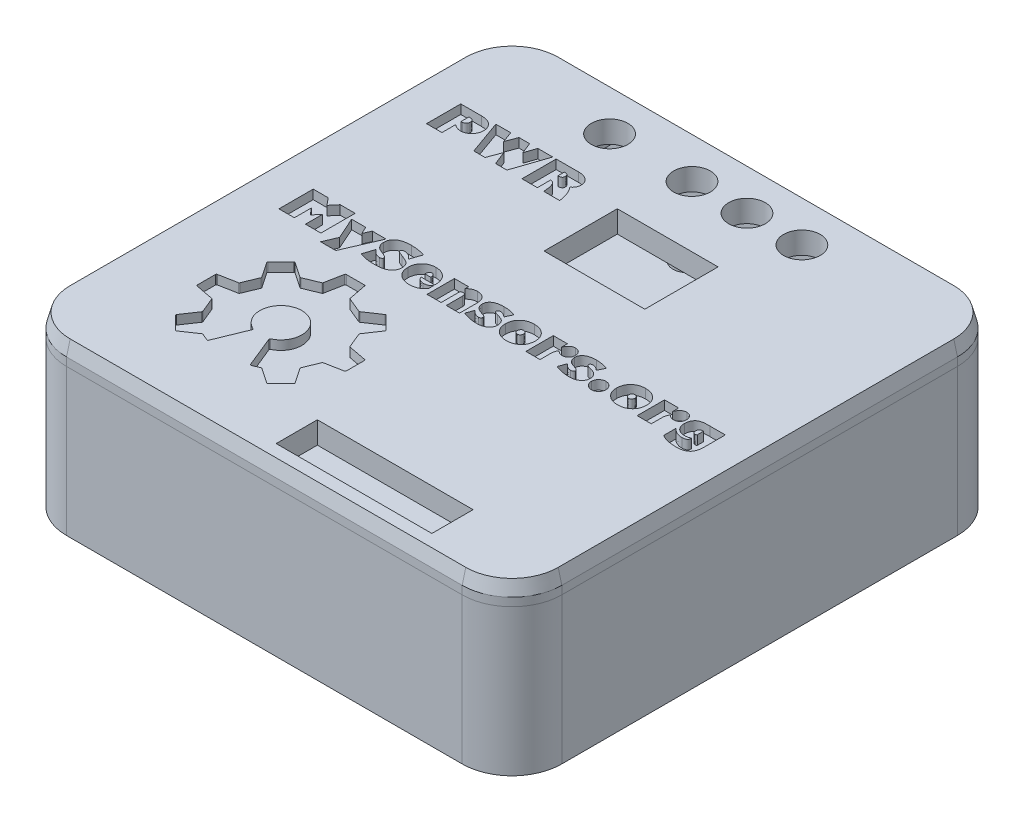
from build123d import *
from OCP.BRepFilletAPI import BRepFilletAPI_MakeChamfer

# Parameters (mm, degrees)
BOSS_EXTRUDE3_DEPTH  = 13.99
BOSS_EXTRUDE4_START  = -2
SKETCH1_3_R          = 2.2
SKETCH1_3_R_2        = 1.6
SKETCH1_3_R_3        = 1.2
BOSS_EXTRUDE4_DEPTH  = 2
SKETCH1_4_R          = 1.2
BOSS_EXTRUDE5_DEPTH  = 12.99
SKETCH1_5_R          = 2.2
SKETCH1_5_R_2        = 1.2
SKETCH1_5_R_3        = 1.6
BOSS_EXTRUDE6_DEPTH  = 7
SKETCH4_R            = 1.4
BOSS_EXTRUDE7_DEPTH  = 1.6
SKETCH5_W            = 5.8
SKETCH5_H            = 7.6
BOSS_EXTRUDE8_DEPTH  = 2.8
SKETCH6_R            = 1.55
BOSS_EXTRUDE9_DEPTH  = 5
SKETCH11_W           = 27
SKETCH11_H           = 8
CUT_EXTRUDE1_DEPTH   = 1.44
SKETCH13_R           = 2
BOSS_EXTRUDE11_DEPTH = 2.4
CHAMFER1_SIZE        = 1.5
CHAMFER1_SIZE2       = 0.4
BOSS_EXTRUDE14_START = 2
SKETCH16_R           = 2.2
SKETCH16_R_2         = 1.4
SKETCH16_R_3         = 2.38
BOSS_EXTRUDE14_DEPTH = 2
BOSS_EXTRUDE15_START = 2
BOSS_EXTRUDE15_DEPTH = 2
CHAMFER2_SIZE        = 1
CHAMFER2_SIZE2       = 0.2
CHAMFER3_SIZE        = 0.2
CHAMFER3_SIZE2       = 0.5
CUT_EXTRUDE3_DEPTH   = 1
CUT_EXTRUDE4_START   = -4.4
SKETCH20_W           = 11
SKETCH20_H           = 8
SKETCH20_W_2         = 17
SKETCH20_H_2         = 4.5
CUT_EXTRUDE4_DEPTH   = 4.4
CUT_EXTRUDE5_DEPTH   = 1


with BuildPart() as part:
    # Sketch1 → Boss-Extrude3 (new body)
    with BuildSketch(Plane(origin=(0, 0, 0), x_dir=(1, 0, 0), z_dir=(0, 1, 0))):
        with BuildLine():
            Line((21.6, 27.04), (-21.6, 27.04))
            ThreePointArc((-21.6, 27.04), (-25.44666089, 25.44666089), (-27.04, 21.6))
            Line((-27.04, 21.6), (-27.04, -21.6))
            ThreePointArc((-27.04, -21.6), (-25.44666089, -25.44666089), (-21.6, -27.04))
            Line((-21.6, -27.04), (21.6, -27.04))
            ThreePointArc((21.6, -27.04), (25.44666089, -25.44666089), (27.04, -21.6))
            Line((27.04, -21.6), (27.04, 21.6))
            ThreePointArc((27.04, 21.6), (25.44666089, 25.44666089), (21.6, 27.04))
        make_face()
        with BuildLine():
            Line((21.6, 25.6), (-21.6, 25.6))
            ThreePointArc((-21.6, 25.6), (-24.428427125, 24.428427125), (-25.6, 21.6))
            Line((-25.6, 21.6), (-25.6, -21.6))
            ThreePointArc((-25.6, -21.6), (-24.428427125, -24.428427125), (-21.6, -25.6))
            Line((-21.6, -25.6), (21.6, -25.6))
            ThreePointArc((21.6, -25.6), (24.428427125, -24.428427125), (25.6, -21.6))
            Line((25.6, -21.6), (25.6, 21.6))
            ThreePointArc((25.6, 21.6), (24.428427125, 24.428427125), (21.6, 25.6))
        make_face(mode=Mode.SUBTRACT)
    extrude(amount=BOSS_EXTRUDE3_DEPTH)

    # Sketch1<3> → Boss-Extrude4 (add)
    # profile 1 of 10: a face of its own
    with BuildSketch(Plane(origin=(0, 0, 0), x_dir=(1, 0, 0), z_dir=(0, 1, 0)).offset(BOSS_EXTRUDE4_START)):
        with BuildLine():
            Line((21.6, 27.04), (-21.6, 27.04))
            ThreePointArc((-21.6, 27.04), (-25.44666089, 25.44666089), (-27.04, 21.6))
            Line((-27.04, 21.6), (-27.04, -21.6))
            ThreePointArc((-27.04, -21.6), (-25.44666089, -25.44666089), (-21.6, -27.04))
            Line((-21.6, -27.04), (21.6, -27.04))
            ThreePointArc((21.6, -27.04), (25.44666089, -25.44666089), (27.04, -21.6))
            Line((27.04, -21.6), (27.04, 21.6))
            ThreePointArc((27.04, 21.6), (25.44666089, 25.44666089), (21.6, 27.04))
        make_face()
        with BuildLine():
            Line((21.6, 25.6), (-21.6, 25.6))
            ThreePointArc((-21.6, 25.6), (-24.428427125, 24.428427125), (-25.6, 21.6))
            Line((-25.6, 21.6), (-25.6, -21.6))
            ThreePointArc((-25.6, -21.6), (-24.428427125, -24.428427125), (-21.6, -25.6))
            Line((-21.6, -25.6), (21.6, -25.6))
            ThreePointArc((21.6, -25.6), (24.428427125, -24.428427125), (25.6, -21.6))
            Line((25.6, -21.6), (25.6, 21.6))
            ThreePointArc((25.6, 21.6), (24.428427125, 24.428427125), (21.6, 25.6))
        make_face(mode=Mode.SUBTRACT)
    # profile 2 of 10: a face of its own
    with BuildSketch(Plane(origin=(0, 0, 0), x_dir=(1, 0, 0), z_dir=(0, 1, 0)).offset(BOSS_EXTRUDE4_START)):
        with BuildLine():
            ThreePointArc((21.6, 25.6), (24.428427125, 24.428427125), (25.6, 21.6))
            Line((25.6, 21.6), (25.6, -21.6))
            ThreePointArc((25.6, -21.6), (24.428427125, -24.428427125), (21.6, -25.6))
            Line((21.6, -25.6), (-21.6, -25.6))
            ThreePointArc((-21.6, -25.6), (-24.428427125, -24.428427125), (-25.6, -21.6))
            Line((-25.6, -21.6), (-25.6, 21.6))
            ThreePointArc((-25.6, 21.6), (-24.428427125, 24.428427125), (-21.6, 25.6))
            Line((-21.6, 25.6), (21.6, 25.6))
        make_face()
        with Locations((-21, -21)):
            Circle(SKETCH1_3_R, mode=Mode.SUBTRACT)
        with Locations((21, -21)):
            Circle(SKETCH1_3_R_2, mode=Mode.SUBTRACT)
        with Locations((21, 21)):
            Circle(SKETCH1_3_R, mode=Mode.SUBTRACT)
        with Locations((-21, 21)):
            Circle(SKETCH1_3_R, mode=Mode.SUBTRACT)
    # profile 3 of 10: a face of its own
    with BuildSketch(Plane(origin=(0, 0, 0), x_dir=(1, 0, 0), z_dir=(0, 1, 0)).offset(BOSS_EXTRUDE4_START)):
        with Locations((-21, -21)):
            Circle(SKETCH1_3_R)
        with Locations((-21, -21)):
            Circle(SKETCH1_3_R_3, mode=Mode.SUBTRACT)
    # profile 4 of 10: a face of its own
    with BuildSketch(Plane(origin=(0, 0, 0), x_dir=(1, 0, 0), z_dir=(0, 1, 0)).offset(BOSS_EXTRUDE4_START)):
        with Locations((-21, -21)):
            Circle(SKETCH1_3_R_3)
    # profile 5 of 10: a face of its own
    with BuildSketch(Plane(origin=(0, 0, 0), x_dir=(1, 0, 0), z_dir=(0, 1, 0)).offset(BOSS_EXTRUDE4_START)):
        with Locations((21, -21)):
            Circle(SKETCH1_3_R_2)
        with Locations((21, -21)):
            Circle(SKETCH1_3_R_3, mode=Mode.SUBTRACT)
    # profile 6 of 10: a face of its own
    with BuildSketch(Plane(origin=(0, 0, 0), x_dir=(1, 0, 0), z_dir=(0, 1, 0)).offset(BOSS_EXTRUDE4_START)):
        with Locations((21, -21)):
            Circle(SKETCH1_3_R_3)
    # profile 7 of 10: a face of its own
    with BuildSketch(Plane(origin=(0, 0, 0), x_dir=(1, 0, 0), z_dir=(0, 1, 0)).offset(BOSS_EXTRUDE4_START)):
        with Locations((-21, 21)):
            Circle(SKETCH1_3_R)
        with Locations((-21, 21)):
            Circle(SKETCH1_3_R_3, mode=Mode.SUBTRACT)
    # profile 8 of 10: a face of its own
    with BuildSketch(Plane(origin=(0, 0, 0), x_dir=(1, 0, 0), z_dir=(0, 1, 0)).offset(BOSS_EXTRUDE4_START)):
        with Locations((-21, 21)):
            Circle(SKETCH1_3_R_3)
    # profile 9 of 10: a face of its own
    with BuildSketch(Plane(origin=(0, 0, 0), x_dir=(1, 0, 0), z_dir=(0, 1, 0)).offset(BOSS_EXTRUDE4_START)):
        with Locations((21, 21)):
            Circle(SKETCH1_3_R)
        with Locations((21, 21)):
            Circle(SKETCH1_3_R_3, mode=Mode.SUBTRACT)
    # profile 10 of 10: a face of its own
    with BuildSketch(Plane(origin=(0, 0, 0), x_dir=(1, 0, 0), z_dir=(0, 1, 0)).offset(BOSS_EXTRUDE4_START)):
        with Locations((21, 21)):
            Circle(SKETCH1_3_R_3)
    extrude(amount=BOSS_EXTRUDE4_DEPTH)

    # Sketch1<4> → Boss-Extrude5 (add)
    with BuildSketch(Plane(origin=(0, 0, 0), x_dir=(1, 0, 0), z_dir=(0, 1, 0))):
        with Locations(Location((21, -21, 0), (0, 0, 270))):
            Circle(SKETCH1_4_R)
        with Locations(Location((-21, -21, 0), (0, 0, 270))):
            Circle(SKETCH1_4_R)
        with Locations(Location((21, 21, 0), (0, 0, 270))):
            Circle(SKETCH1_4_R)
        with Locations(Location((-21, 21, 0), (0, 0, 270))):
            Circle(SKETCH1_4_R)
    extrude(amount=BOSS_EXTRUDE5_DEPTH)

    # Sketch1<5> → Boss-Extrude6 (add)
    # profile 1 of 4: a face of its own
    with BuildSketch(Plane(origin=(0, 0, 0), x_dir=(1, 0, 0), z_dir=(0, 1, 0))):
        with Locations(Location((-21, -21, 0), (0, 0, 270))):
            Circle(SKETCH1_5_R)
        with Locations(Location((-21, -21, 0), (0, 0, 270))):
            Circle(SKETCH1_5_R_2, mode=Mode.SUBTRACT)
    # profile 2 of 4: a face of its own
    with BuildSketch(Plane(origin=(0, 0, 0), x_dir=(1, 0, 0), z_dir=(0, 1, 0))):
        with Locations(Location((-21, 21, 0), (0, 0, 270))):
            Circle(SKETCH1_5_R)
        with Locations(Location((-21, 21, 0), (0, 0, 270))):
            Circle(SKETCH1_5_R_2, mode=Mode.SUBTRACT)
    # profile 3 of 4: a face of its own
    with BuildSketch(Plane(origin=(0, 0, 0), x_dir=(1, 0, 0), z_dir=(0, 1, 0))):
        with Locations(Location((21, -21, 0), (0, 0, 270))):
            Circle(SKETCH1_5_R_3)
        with Locations(Location((21, -21, 0), (0, 0, 270))):
            Circle(SKETCH1_5_R_2, mode=Mode.SUBTRACT)
    # profile 4 of 4: a face of its own
    with BuildSketch(Plane(origin=(0, 0, 0), x_dir=(1, 0, 0), z_dir=(0, 1, 0))):
        with Locations(Location((21, 21, 0), (0, 0, 270))):
            Circle(SKETCH1_5_R)
        with Locations(Location((21, 21, 0), (0, 0, 270))):
            Circle(SKETCH1_5_R_2, mode=Mode.SUBTRACT)
    extrude(amount=BOSS_EXTRUDE6_DEPTH)

    # Sketch11 → Cut-Extrude1 (cut)
    with BuildSketch(Plane.ZY.offset(27.04)):
        with Locations((5.467000574, 10)):
            Rectangle(SKETCH11_W, SKETCH11_H)
    extrude(amount=-CUT_EXTRUDE1_DEPTH, mode=Mode.SUBTRACT)


with BuildPart() as body_2:
    # Sketch4 → Boss-Extrude7 (new body)
    with BuildSketch(Plane(origin=(0, 7, 0), x_dir=(1, 0, 0), z_dir=(0, 1, 0))):
        with BuildLine():
            Line((-21, 25), (21, 25))
            ThreePointArc((21, 25), (23.828427125, 23.828427125), (25, 21))
            Line((25, 21), (25, -21))
            ThreePointArc((25, -21), (23.828427125, -23.828427125), (21, -25))
            Line((21, -25), (-21, -25))
            ThreePointArc((-21, -25), (-23.828427125, -23.828427125), (-25, -21))
            Line((-25, -21), (-25, 21))
            ThreePointArc((-25, 21), (-23.828427125, 23.828427125), (-21, 25))
        make_face()
        with Locations(Location((-21, 21, 0), (0, 0, 270))):
            Circle(SKETCH4_R, mode=Mode.SUBTRACT)
        with Locations(Location((21, 21, 0), (0, 0, 270))):
            Circle(SKETCH4_R, mode=Mode.SUBTRACT)
        with Locations(Location((21, -21, 0), (0, 0, 270))):
            Circle(SKETCH4_R, mode=Mode.SUBTRACT)
        with Locations(Location((-21, -21, 0), (0, 0, 270))):
            Circle(SKETCH4_R, mode=Mode.SUBTRACT)
    extrude(amount=BOSS_EXTRUDE7_DEPTH)

    # Sketch5 → Boss-Extrude8 (add)
    with BuildSketch(Plane(origin=(0, 8.6, 0), x_dir=(1, 0, 0), z_dir=(0, 1, 0))):
        with Locations((-22.1, -13)):
            Rectangle(SKETCH5_W, SKETCH5_H)
        with Locations((-22.1, 0)):
            Rectangle(SKETCH5_W, SKETCH5_H)
    extrude(amount=BOSS_EXTRUDE8_DEPTH)

    # Sketch6 → Boss-Extrude9 (add)
    with BuildSketch(Plane(origin=(0, 8.6, 0), x_dir=(1, 0, 0), z_dir=(0, 1, 0))):
        with Locations(Location((-12.064515625, 22.193546875, 0), (0, 0, 270))):
            Circle(SKETCH6_R)
        with Locations(Location((-3.064515625, 22.193546875, 0), (0, 0, 270))):
            Circle(SKETCH6_R)
        with Locations(Location((2.935484375, 22.193546875, 0), (0, 0, 270))):
            Circle(SKETCH6_R)
        with Locations(Location((8.935484375, 22.193546875, 0), (0, 0, 270))):
            Circle(SKETCH6_R)
    extrude(amount=BOSS_EXTRUDE9_DEPTH)


with BuildPart() as body_3:
    # Sketch13 → Boss-Extrude11 (new body)
    with BuildSketch(Plane(origin=(0, 13.99, 0), x_dir=(1, 0, 0), z_dir=(0, 1, 0))):
        with BuildLine():
            Line((21.6, -27.04), (-21.6, -27.04))
            ThreePointArc((-21.6, -27.04), (-25.44666089, -25.44666089), (-27.04, -21.6))
            Line((-27.04, -21.6), (-27.04, 21.6))
            ThreePointArc((-27.04, 21.6), (-25.44666089, 25.44666089), (-21.6, 27.04))
            Line((-21.6, 27.04), (21.6, 27.04))
            ThreePointArc((21.6, 27.04), (25.44666089, 25.44666089), (27.04, 21.6))
            Line((27.04, 21.6), (27.04, -21.6))
            ThreePointArc((27.04, -21.6), (25.44666089, -25.44666089), (21.6, -27.04))
        make_face()
        with Locations(Location((-11.54, 22.193546875, 0), (0, 0, 270))):
            Circle(SKETCH13_R, mode=Mode.SUBTRACT)
        with Locations(Location((-2.54, 22.193546875, 0), (0, 0, 270))):
            Circle(SKETCH13_R, mode=Mode.SUBTRACT)
        with Locations(Location((3.46, 22.193546875, 0), (0, 0, 270))):
            Circle(SKETCH13_R, mode=Mode.SUBTRACT)
        with Locations(Location((9.46, 22.193546875, 0), (0, 0, 270))):
            Circle(SKETCH13_R, mode=Mode.SUBTRACT)
    extrude(amount=BOSS_EXTRUDE11_DEPTH)

    # Chamfer1: one chamfer whose edges measure the first distance from different faces: ONE call of the kernel's chamfer builder (chamfer() names one face for all edges)
    chamfer1_edges_1 = [body_3.edges().sort_by_distance(p)[0] for p in [
        (25.44666089, 16.39, 25.44666089),
    ]]
    chamfer1_side_1 = [body_3.faces().sort_by_distance(p)[0] for p in [
        (25.44666089, 15.19, 25.44666089),
    ]]
    chamfer1_edges_2 = [body_3.edges().sort_by_distance(p)[0] for p in [
        (27.04, 16.39, 0),
    ]]
    chamfer1_side_2 = [body_3.faces().sort_by_distance(p)[0] for p in [
        (27.04, 15.19, 0),
    ]]
    chamfer1_edges_3 = [body_3.edges().sort_by_distance(p)[0] for p in [
        (25.44666089, 16.39, -25.44666089),
    ]]
    chamfer1_side_3 = [body_3.faces().sort_by_distance(p)[0] for p in [
        (25.44666089, 15.19, -25.44666089),
    ]]
    chamfer1_edges_4 = [body_3.edges().sort_by_distance(p)[0] for p in [
        (0, 16.39, -27.04),
    ]]
    chamfer1_side_4 = [body_3.faces().sort_by_distance(p)[0] for p in [
        (0, 15.19, -27.04),
    ]]
    chamfer1_edges_5 = [body_3.edges().sort_by_distance(p)[0] for p in [
        (-25.44666089, 16.39, -25.44666089),
    ]]
    chamfer1_side_5 = [body_3.faces().sort_by_distance(p)[0] for p in [
        (-25.44666089, 15.19, -25.44666089),
    ]]
    chamfer1_edges_6 = [body_3.edges().sort_by_distance(p)[0] for p in [
        (-27.04, 16.39, 0),
    ]]
    chamfer1_side_6 = [body_3.faces().sort_by_distance(p)[0] for p in [
        (-27.04, 15.19, 0),
    ]]
    chamfer1_edges_7 = [body_3.edges().sort_by_distance(p)[0] for p in [
        (-25.44666089, 16.39, 25.44666089),
    ]]
    chamfer1_side_7 = [body_3.faces().sort_by_distance(p)[0] for p in [
        (-25.44666089, 15.19, 25.44666089),
    ]]
    chamfer1_edges_8 = [body_3.edges().sort_by_distance(p)[0] for p in [
        (0, 16.39, 27.04),
    ]]
    chamfer1_side_8 = [body_3.faces().sort_by_distance(p)[0] for p in [
        (0, 15.19, 27.04),
    ]]
    chamfer1 = BRepFilletAPI_MakeChamfer(body_3.part.solid().wrapped)
    for e in chamfer1_edges_1:
        chamfer1.Add(CHAMFER1_SIZE, CHAMFER1_SIZE2, e.wrapped, chamfer1_side_1[0].wrapped)  # the first distance lies on this face
    for e in chamfer1_edges_2:
        chamfer1.Add(CHAMFER1_SIZE, CHAMFER1_SIZE2, e.wrapped, chamfer1_side_2[0].wrapped)  # the first distance lies on this face
    for e in chamfer1_edges_3:
        chamfer1.Add(CHAMFER1_SIZE, CHAMFER1_SIZE2, e.wrapped, chamfer1_side_3[0].wrapped)  # the first distance lies on this face
    for e in chamfer1_edges_4:
        chamfer1.Add(CHAMFER1_SIZE, CHAMFER1_SIZE2, e.wrapped, chamfer1_side_4[0].wrapped)  # the first distance lies on this face
    for e in chamfer1_edges_5:
        chamfer1.Add(CHAMFER1_SIZE, CHAMFER1_SIZE2, e.wrapped, chamfer1_side_5[0].wrapped)  # the first distance lies on this face
    for e in chamfer1_edges_6:
        chamfer1.Add(CHAMFER1_SIZE, CHAMFER1_SIZE2, e.wrapped, chamfer1_side_6[0].wrapped)  # the first distance lies on this face
    for e in chamfer1_edges_7:
        chamfer1.Add(CHAMFER1_SIZE, CHAMFER1_SIZE2, e.wrapped, chamfer1_side_7[0].wrapped)  # the first distance lies on this face
    for e in chamfer1_edges_8:
        chamfer1.Add(CHAMFER1_SIZE, CHAMFER1_SIZE2, e.wrapped, chamfer1_side_8[0].wrapped)  # the first distance lies on this face
    add(Compound.cast(chamfer1.Shape()), mode=Mode.REPLACE)

    # Sketch16 → Boss-Extrude14 (add)
    # profile 1 of 4: a face of its own
    with BuildSketch(Plane.XZ.offset(-13.99).offset(BOSS_EXTRUDE14_START)):
        with Locations(Location((-21, -21, 0), (0, 0, 90))):
            Circle(SKETCH16_R)
        with Locations(Location((-21, -21, 0), (0, 0, 270))):
            Circle(SKETCH16_R_2, mode=Mode.SUBTRACT)
    # profile 2 of 4: a face of its own
    with BuildSketch(Plane.XZ.offset(-13.99).offset(BOSS_EXTRUDE14_START)):
        with Locations(Location((21, -21, 0), (0, 0, 90))):
            Circle(SKETCH16_R)
        with Locations(Location((21, -21, 0), (0, 0, 270))):
            Circle(SKETCH16_R_2, mode=Mode.SUBTRACT)
    # profile 3 of 4: a face of its own
    with BuildSketch(Plane.XZ.offset(-13.99).offset(BOSS_EXTRUDE14_START)):
        with Locations(Location((21, 21, 0), (0, 0, 90))):
            Circle(SKETCH16_R_3)
        with Locations(Location((21, 21, 0), (0, 0, 270))):
            Circle(SKETCH16_R_2, mode=Mode.SUBTRACT)
    # profile 4 of 4: a face of its own
    with BuildSketch(Plane.XZ.offset(-13.99).offset(BOSS_EXTRUDE14_START)):
        with Locations(Location((-21, 21, 0), (0, 0, 90))):
            Circle(SKETCH16_R)
        with Locations(Location((-21, 21, 0), (0, 0, 270))):
            Circle(SKETCH16_R_2, mode=Mode.SUBTRACT)
    extrude(amount=-BOSS_EXTRUDE14_DEPTH)

    # Sketch17 → Boss-Extrude15 (add)
    with BuildSketch(Plane.XZ.offset(-13.99).offset(BOSS_EXTRUDE15_START)):
        with BuildLine():
            Line((-21.6, 23.6), (21.6, 23.6))
            ThreePointArc((21.6, 23.6), (23.014213562, 23.014213562), (23.6, 21.6))
            Line((23.6, 21.6), (23.6, -21.6))
            ThreePointArc((23.6, -21.6), (23.014213562, -23.014213562), (21.6, -23.6))
            Line((21.6, -23.6), (12.271049493, -23.6))
            Line((12.271049493, -23.6), (12.271049493, -25.6))
            Line((12.271049493, -25.6), (21.6, -25.6))
            ThreePointArc((21.6, -25.6), (24.428427125, -24.428427125), (25.6, -21.6))
            Line((25.6, -21.6), (25.6, 21.6))
            ThreePointArc((25.6, 21.6), (24.428427125, 24.428427125), (21.6, 25.6))
            Line((21.6, 25.6), (-21.6, 25.6))
            ThreePointArc((-21.6, 25.6), (-24.428427125, 24.428427125), (-25.6, 21.6))
            Line((-25.6, 21.6), (-25.6, 18.967000574))
            Line((-25.6, 18.967000574), (-24.1, 18.967000574))
            Line((-24.1, 18.967000574), (-23.6, 18.967000574))
            Line((-23.6, 18.967000574), (-23.6, 21.6))
            ThreePointArc((-23.6, 21.6), (-23.014213562, 23.014213562), (-21.6, 23.6))
        make_face()
        with BuildLine():
            Line((-21.6, -23.6), (-14.849726858, -23.6))
            Line((-14.849726858, -23.6), (-14.849726858, -25.6))
            Line((-14.849726858, -25.6), (-21.6, -25.6))
            ThreePointArc((-21.6, -25.6), (-24.428427125, -24.428427125), (-25.6, -21.6))
            Line((-25.6, -21.6), (-23.6, -21.6))
            ThreePointArc((-23.6, -21.6), (-23.014213562, -23.014213562), (-21.6, -23.6))
        make_face()
    extrude(amount=-BOSS_EXTRUDE15_DEPTH)

    # Chamfer2: one chamfer whose edges measure the first distance from different faces: ONE call of the kernel's chamfer builder (chamfer() names one face for all edges)
    chamfer2_edges_1 = [body_3.edges().sort_by_distance(p)[0] for p in [
        (16.935524747, 11.99, -25.6),
    ]]
    chamfer2_side_1 = [body_3.faces().sort_by_distance(p)[0] for p in [
        (16.935524747, 12.99, -25.6),
    ]]
    chamfer2_edges_2 = [body_3.edges().sort_by_distance(p)[0] for p in [
        (24.428427125, 11.99, -24.428427125),
    ]]
    chamfer2_side_2 = [body_3.faces().sort_by_distance(p)[0] for p in [
        (24.428427125, 12.99, -24.428427125),
    ]]
    chamfer2_edges_3 = [body_3.edges().sort_by_distance(p)[0] for p in [
        (25.6, 11.99, 0),
    ]]
    chamfer2_side_3 = [body_3.faces().sort_by_distance(p)[0] for p in [
        (25.6, 12.99, 0),
    ]]
    chamfer2_edges_4 = [body_3.edges().sort_by_distance(p)[0] for p in [
        (24.428427125, 11.99, 24.428427125),
    ]]
    chamfer2_side_4 = [body_3.faces().sort_by_distance(p)[0] for p in [
        (24.428427125, 12.99, 24.428427125),
    ]]
    chamfer2_edges_5 = [body_3.edges().sort_by_distance(p)[0] for p in [
        (0, 11.99, 25.6),
    ]]
    chamfer2_side_5 = [body_3.faces().sort_by_distance(p)[0] for p in [
        (0, 12.99, 25.6),
    ]]
    chamfer2_edges_6 = [body_3.edges().sort_by_distance(p)[0] for p in [
        (-24.428427125, 11.99, 24.428427125),
    ]]
    chamfer2_side_6 = [body_3.faces().sort_by_distance(p)[0] for p in [
        (-24.428427125, 12.99, 24.428427125),
    ]]
    chamfer2_edges_7 = [body_3.edges().sort_by_distance(p)[0] for p in [
        (-25.6, 11.99, 20.283500287),
    ]]
    chamfer2_side_7 = [body_3.faces().sort_by_distance(p)[0] for p in [
        (-25.6, 12.99, 20.283500287),
    ]]
    chamfer2 = BRepFilletAPI_MakeChamfer(body_3.part.solid().wrapped)
    for e in chamfer2_edges_1:
        chamfer2.Add(CHAMFER2_SIZE, CHAMFER2_SIZE2, e.wrapped, chamfer2_side_1[0].wrapped)  # the first distance lies on this face
    for e in chamfer2_edges_2:
        chamfer2.Add(CHAMFER2_SIZE, CHAMFER2_SIZE2, e.wrapped, chamfer2_side_2[0].wrapped)  # the first distance lies on this face
    for e in chamfer2_edges_3:
        chamfer2.Add(CHAMFER2_SIZE, CHAMFER2_SIZE2, e.wrapped, chamfer2_side_3[0].wrapped)  # the first distance lies on this face
    for e in chamfer2_edges_4:
        chamfer2.Add(CHAMFER2_SIZE, CHAMFER2_SIZE2, e.wrapped, chamfer2_side_4[0].wrapped)  # the first distance lies on this face
    for e in chamfer2_edges_5:
        chamfer2.Add(CHAMFER2_SIZE, CHAMFER2_SIZE2, e.wrapped, chamfer2_side_5[0].wrapped)  # the first distance lies on this face
    for e in chamfer2_edges_6:
        chamfer2.Add(CHAMFER2_SIZE, CHAMFER2_SIZE2, e.wrapped, chamfer2_side_6[0].wrapped)  # the first distance lies on this face
    for e in chamfer2_edges_7:
        chamfer2.Add(CHAMFER2_SIZE, CHAMFER2_SIZE2, e.wrapped, chamfer2_side_7[0].wrapped)  # the first distance lies on this face
    add(Compound.cast(chamfer2.Shape()), mode=Mode.REPLACE)

    # Chamfer3: one chamfer whose edges measure the first distance from different faces: ONE call of the kernel's chamfer builder (chamfer() names one face for all edges)
    chamfer3_edges_1 = [body_3.edges().sort_by_distance(p)[0] for p in [
        (-21, 11.99, -19.6),
    ]]
    chamfer3_side_1 = [body_3.faces().sort_by_distance(p)[0] for p in [
        (-21, 11.99, -23.137774603),
    ]]
    chamfer3_edges_2 = [body_3.edges().sort_by_distance(p)[0] for p in [
        (21, 11.99, -19.6),
    ]]
    chamfer3_side_2 = [body_3.faces().sort_by_distance(p)[0] for p in [
        (21, 11.99, -23.137774603),
    ]]
    chamfer3_edges_3 = [body_3.edges().sort_by_distance(p)[0] for p in [
        (-21, 11.99, 22.4),
    ]]
    chamfer3_side_3 = [body_3.faces().sort_by_distance(p)[0] for p in [
        (-21, 11.99, 18.862225397),
    ]]
    chamfer3 = BRepFilletAPI_MakeChamfer(body_3.part.solid().wrapped)
    for e in chamfer3_edges_1:
        chamfer3.Add(CHAMFER3_SIZE, CHAMFER3_SIZE2, e.wrapped, chamfer3_side_1[0].wrapped)  # the first distance lies on this face
    for e in chamfer3_edges_2:
        chamfer3.Add(CHAMFER3_SIZE, CHAMFER3_SIZE2, e.wrapped, chamfer3_side_2[0].wrapped)  # the first distance lies on this face
    for e in chamfer3_edges_3:
        chamfer3.Add(CHAMFER3_SIZE, CHAMFER3_SIZE2, e.wrapped, chamfer3_side_3[0].wrapped)  # the first distance lies on this face
    add(Compound.cast(chamfer3.Shape()), mode=Mode.REPLACE)

    # Sketch19 → Cut-Extrude3 (cut)
    with BuildSketch(Plane(origin=(0, 16.39, 0), x_dir=(1, 0, 0), z_dir=(0, 1, 0))):
        with BuildLine():
            Line((-12.535848014, -15.82851334), (-13.913372742, -19.202283103))
            ThreePointArc((-13.913372742, -19.202283103), (-13.970155159, -19.25949766), (-14.050763708, -19.259599517))
            Line((-14.050763708, -19.259599517), (-14.798990946, -18.949673647))
            ThreePointArc((-14.798990946, -18.949673647), (-14.849765669, -18.942216702), (-14.89800992, -18.959714439))
            Line((-14.89800992, -18.959714439), (-16.543545548, -20.073001347))
            ThreePointArc((-16.543545548, -20.073001347), (-16.612373313, -20.090558416), (-16.676628973, -20.060281))
            Line((-16.676628973, -20.060281), (-18.082563925, -18.654346049))
            ThreePointArc((-18.082563925, -18.654346049), (-18.112841341, -18.590090388), (-18.095284271, -18.521262623))
            Line((-18.095284271, -18.521262623), (-16.981997364, -16.875726995))
            ThreePointArc((-16.981997364, -16.875726995), (-16.964499626, -16.827482744), (-16.971956571, -16.776708021))
            Line((-16.971956571, -16.776708021), (-17.648787612, -15.142693343))
            ThreePointArc((-17.648787612, -15.142693343), (-17.679417907, -15.101517335), (-17.725904512, -15.079776267))
            Line((-17.725904512, -15.079776267), (-19.676686635, -14.703419588))
            ThreePointArc((-19.676686635, -14.703419588), (-19.737769938, -14.667165731), (-19.761796185, -14.600320752))
            Line((-19.761796185, -14.600320752), (-19.761796185, -12.612028476))
            ThreePointArc((-19.761796185, -12.612028476), (-19.737769938, -12.545183496), (-19.676686635, -12.50892964))
            Line((-19.676686635, -12.50892964), (-17.725904512, -12.13257296))
            ThreePointArc((-17.725904512, -12.13257296), (-17.679417907, -12.110831892), (-17.648787612, -12.069655885))
            Line((-17.648787612, -12.069655885), (-16.971956571, -10.435641206))
            ThreePointArc((-16.971956571, -10.435641206), (-16.964499626, -10.384866483), (-16.981997364, -10.336622232))
            Line((-16.981997364, -10.336622232), (-18.095284271, -8.691086604))
            ThreePointArc((-18.095284271, -8.691086604), (-18.112841341, -8.622258839), (-18.082563925, -8.558003179))
            Line((-18.082563925, -8.558003179), (-16.676628973, -7.152068227))
            ThreePointArc((-16.676628973, -7.152068227), (-16.612373313, -7.121790811), (-16.543545548, -7.139347881))
            Line((-16.543545548, -7.139347881), (-14.89800992, -8.252634788))
            ThreePointArc((-14.89800992, -8.252634788), (-14.849765669, -8.270132526), (-14.798990946, -8.262675581))
            Line((-14.798990946, -8.262675581), (-13.164976267, -7.58584454))
            ThreePointArc((-13.164976267, -7.58584454), (-13.12380026, -7.555214245), (-13.102059192, -7.508727639))
            Line((-13.102059192, -7.508727639), (-12.725702512, -5.557945516))
            ThreePointArc((-12.725702512, -5.557945516), (-12.689448656, -5.496862214), (-12.622603676, -5.472835967))
            Line((-12.622603676, -5.472835967), (-10.6343114, -5.472835967))
            ThreePointArc((-10.6343114, -5.472835967), (-10.56746642, -5.496862214), (-10.531212564, -5.557945516))
            Line((-10.531212564, -5.557945516), (-10.154855885, -7.508727639))
            ThreePointArc((-10.154855885, -7.508727639), (-10.133114817, -7.555214245), (-10.091938809, -7.58584454))
            Line((-10.091938809, -7.58584454), (-8.457924131, -8.262675581))
            ThreePointArc((-8.457924131, -8.262675581), (-8.407149407, -8.270132526), (-8.358905157, -8.252634788))
            Line((-8.358905157, -8.252634788), (-6.713369529, -7.139347881))
            ThreePointArc((-6.713369529, -7.139347881), (-6.644541764, -7.121790811), (-6.580286103, -7.152068227))
            Line((-6.580286103, -7.152068227), (-5.174351152, -8.558003179))
            ThreePointArc((-5.174351152, -8.558003179), (-5.144073736, -8.622258839), (-5.161630805, -8.691086604))
            Line((-5.161630805, -8.691086604), (-6.274917713, -10.336622232))
            ThreePointArc((-6.274917713, -10.336622232), (-6.29241545, -10.384866483), (-6.284958505, -10.435641206))
            Line((-6.284958505, -10.435641206), (-5.608127464, -12.069655885))
            ThreePointArc((-5.608127464, -12.069655885), (-5.57749717, -12.110831892), (-5.531010564, -12.13257296))
            Line((-5.531010564, -12.13257296), (-3.580228441, -12.50892964))
            ThreePointArc((-3.580228441, -12.50892964), (-3.519145139, -12.545183496), (-3.495118892, -12.612028476))
            Line((-3.495118892, -12.612028476), (-3.495118892, -14.600320752))
            ThreePointArc((-3.495118892, -14.600320752), (-3.519145139, -14.667165731), (-3.580228441, -14.703419588))
            Line((-3.580228441, -14.703419588), (-5.531010564, -15.079776267))
            ThreePointArc((-5.531010564, -15.079776267), (-5.57749717, -15.101517335), (-5.608127464, -15.142693343))
            Line((-5.608127464, -15.142693343), (-6.284958505, -16.776708021))
            ThreePointArc((-6.284958505, -16.776708021), (-6.29241545, -16.827482744), (-6.274917713, -16.875726995))
            Line((-6.274917713, -16.875726995), (-5.161630805, -18.521262623))
            ThreePointArc((-5.161630805, -18.521262623), (-5.144073736, -18.590090388), (-5.174351152, -18.654346049))
            Line((-5.174351152, -18.654346049), (-6.580286103, -20.060281))
            ThreePointArc((-6.580286103, -20.060281), (-6.644541764, -20.090558416), (-6.713369529, -20.073001347))
            Line((-6.713369529, -20.073001347), (-8.358905157, -18.959714439))
            ThreePointArc((-8.358905157, -18.959714439), (-8.407149407, -18.942216702), (-8.457924131, -18.949673647))
            Line((-8.457924131, -18.949673647), (-9.206151369, -19.259599517))
            ThreePointArc((-9.206151369, -19.259599517), (-9.286759917, -19.25949766), (-9.343542334, -19.202283103))
            Line((-9.343542334, -19.202283103), (-10.721067062, -15.82851334))
            ThreePointArc((-10.721067062, -15.82851334), (-10.721526641, -15.750276215), (-10.667758926, -15.693440559))
            ThreePointArc((-10.667758926, -15.693440559), (-11.628457538, -11.308432037), (-12.589156151, -15.693440559))
            ThreePointArc((-12.589156151, -15.693440559), (-12.535388435, -15.750276215), (-12.535848014, -15.82851334))
        make_face()
    extrude(amount=-CUT_EXTRUDE3_DEPTH, mode=Mode.SUBTRACT)

    # Sketch20 → Cut-Extrude4 (cut)
    with BuildSketch(Plane(origin=(0, 16.39, 0), x_dir=(1, 0, 0), z_dir=(0, 1, 0)).offset(CUT_EXTRUDE4_START)):
        with Locations((1.46, 11.54)):
            Rectangle(SKETCH20_W, SKETCH20_H)
        with Locations((8.04, -23.04)):
            Rectangle(SKETCH20_W_2, SKETCH20_H_2)
    extrude(amount=CUT_EXTRUDE4_DEPTH, mode=Mode.SUBTRACT)

    # Sketch21 → Cut-Extrude5 (cut)
    # profile 1 of 16: a face of its own
    with BuildSketch(Plane(origin=(0, 16.39, 0), x_dir=(1, 0, 0), z_dir=(0, 1, 0))):
        with BuildLine():
            Line((-22.499438825, 16.904203898), (-20.214337941, 16.904203898))
            add(Edge.make_bspline(
                [(-20.214337941, 16.904203898), (-20.155636813, 16.90318479), (-20.041609105, 16.90120516), (-19.875976393, 16.882979578), (-19.720574513, 16.855585618), (-19.576120965, 16.814096552), (-19.441348282, 16.76276111), (-19.317699492, 16.698124821), (-19.204051504, 16.622603663), (-19.102073563, 16.535418885), (-19.011305199, 16.440113911), (-18.931802962, 16.339045272), (-18.86488426, 16.232291911), (-18.809602864, 16.1201559), (-18.767442675, 16.001945772), (-18.736530714, 15.878542778), (-18.71787757, 15.749570736), (-18.715826842, 15.661696293), (-18.714786115, 15.617100749)],
                knots=[0, 0, 0, 0, 1.265897939, 2.459023298, 3.590655966, 4.6658395, 5.696325296, 6.696614833, 7.669245096, 8.633851534, 9.584427266, 10.50438584, 11.403098331, 12.297630456, 13.196020891, 14.105130518, 15.038369601, 16, 16, 16, 16], degree=3))
            add(Edge.make_bspline(
                [(-18.714786115, 15.617100749), (-18.715922466, 15.573242666), (-18.718153248, 15.487144414), (-18.73534721, 15.360468233), (-18.763692909, 15.238885659), (-18.803945783, 15.122106098), (-18.85647508, 15.010684111), (-18.918975606, 14.903537202), (-18.994543462, 14.802543092), (-19.078943743, 14.706947883), (-19.171737965, 14.619801315), (-19.270565614, 14.543574737), (-19.373951842, 14.478888402), (-19.482006214, 14.425830278), (-19.595100602, 14.38472945), (-19.713069107, 14.355723296), (-19.835603976, 14.337612601), (-19.918842423, 14.335465545), (-19.96100567, 14.334377984)],
                knots=[0, 0, 0, 0, 1.05788585, 2.076746538, 3.077927521, 4.065745769, 5.050750735, 6.045628022, 7.053175907, 8.08881572, 9.118965369, 10.119526383, 11.095389573, 12.056445067, 13.018558133, 13.992582672, 14.983171413, 16, 16, 16, 16], degree=3))
            add(Edge.make_bspline(
                [(-19.96100567, 14.334377984), (-19.996833522, 14.335365969), (-20.068812006, 14.337350839), (-20.176577217, 14.353441529), (-20.284133417, 14.378853898), (-20.391399121, 14.41534826), (-20.498954508, 14.460984261), (-20.605508837, 14.519120178), (-20.713288399, 14.584842153), (-20.782224082, 14.636062233), (-20.817370954, 14.662176801)],
                knots=[0, 0, 0, 0, 0.920542292, 1.849377925, 2.794581966, 3.757888371, 4.758274964, 5.793678998, 6.875106795, 8, 8, 8, 8], degree=3))
            Line((-20.817370954, 14.662176801), (-20.817370954, 13.166275296))
            Line((-20.817370954, 13.166275296), (-22.499438825, 13.166275296))
            Line((-22.499438825, 13.166275296), (-22.499438825, 16.904203898))
        make_face()
        with BuildLine():
            Line((-20.817370954, 16.10989407), (-20.817370954, 15.268860135))
            add(Edge.make_bspline(
                [(-20.817370954, 15.268860135), (-20.793387656, 15.263209813), (-20.747731808, 15.252453567), (-20.700892901, 15.250212312), (-20.678658759, 15.249148402)],
                knots=[0, 0, 0, 0, 1.050612292, 2, 2, 2, 2], degree=3))
            add(Edge.make_bspline(
                [(-20.678658759, 15.249148402), (-20.648538905, 15.250280751), (-20.590223767, 15.252473097), (-20.508023448, 15.277077657), (-20.433980149, 15.31458101), (-20.371300482, 15.368709241), (-20.319971624, 15.434408294), (-20.282667955, 15.510920499), (-20.260437478, 15.597122853), (-20.25796525, 15.657848313), (-20.256681663, 15.689377102)],
                knots=[0, 0, 0, 0, 1.051353325, 2.035528233, 2.976728174, 3.937769127, 4.909139102, 5.876915834, 6.897690127, 8, 8, 8, 8], degree=3))
            add(Edge.make_bspline(
                [(-20.256681663, 15.689377102), (-20.257554406, 15.720159716), (-20.259228684, 15.779213365), (-20.278719337, 15.862355997), (-20.309129296, 15.9361392), (-20.353788594, 15.99798269), (-20.408933964, 16.049238501), (-20.476833158, 16.084424494), (-20.55444554, 16.106123607), (-20.609635718, 16.10859914), (-20.63850523, 16.10989407)],
                knots=[0, 0, 0, 0, 1.145570227, 2.19767251, 3.165102602, 4.10174684, 5.020329633, 5.945832421, 6.925482455, 8, 8, 8, 8], degree=3))
            Line((-20.63850523, 16.10989407), (-20.817370954, 16.10989407))
        make_face(mode=Mode.SUBTRACT)
    # profile 2 of 16: a face of its own
    with BuildSketch(Plane(origin=(0, 16.39, 0), x_dir=(1, 0, 0), z_dir=(0, 1, 0))):
        Polygon((-16.106266799, 13.166275296), (-17.334964814, 13.166275296), (-18.668062007, 16.904203898), (-17.038558757, 16.904203898), (-16.600520249, 15.684266653), (-16.140579816, 16.904203898), (-14.981237897, 16.904203898), (-14.498665474, 15.684266653), (-14.086179213, 16.904203898), (-12.453755706, 16.904203898), (-13.724797443, 13.166275296), (-14.956415715, 13.166275296), (-15.552148086, 14.654876159), align=None)
    # profile 3 of 16: a face of its own
    with BuildSketch(Plane(origin=(0, 16.39, 0), x_dir=(1, 0, 0), z_dir=(0, 1, 0))):
        with BuildLine():
            Line((-12.079962846, 16.904203898), (-9.618916494, 16.904203898))
            add(Edge.make_bspline(
                [(-9.618916494, 16.904203898), (-9.56705019, 16.903192456), (-9.46578229, 16.901217637), (-9.318309291, 16.886764262), (-9.179465012, 16.861831115), (-9.049193624, 16.827781287), (-8.927110328, 16.7838975), (-8.813515443, 16.73017043), (-8.709180572, 16.66513866), (-8.61375457, 16.591787888), (-8.528500669, 16.510708319), (-8.453612627, 16.424593972), (-8.390248634, 16.333262765), (-8.337921726, 16.237225417), (-8.297530103, 16.135741274), (-8.269059947, 16.029162741), (-8.252021752, 15.917706404), (-8.249742163, 15.841776409), (-8.248586028, 15.803267114)],
                knots=[0, 0, 0, 0, 1.262539922, 2.465083451, 3.602734072, 4.693385877, 5.739073491, 6.756608793, 7.746290342, 8.726242866, 9.681678187, 10.605704461, 11.499692491, 12.382421026, 13.262501618, 14.152042409, 15.062774299, 16, 16, 16, 16], degree=3))
            add(Edge.make_bspline(
                [(-8.248586028, 15.803267114), (-8.249724322, 15.761076628), (-8.25195583, 15.678366596), (-8.273110872, 15.558043727), (-8.306483185, 15.444637642), (-8.353840474, 15.338501359), (-8.413915213, 15.238979642), (-8.488607815, 15.147470456), (-8.576121498, 15.062309519), (-8.642904029, 15.013521829), (-8.677133702, 14.988515489)],
                knots=[0, 0, 0, 0, 1.053039494, 2.06437372, 3.041364979, 3.999259109, 4.959407223, 5.936285013, 6.942234014, 8, 8, 8, 8], degree=3))
            add(Edge.make_bspline(
                [(-8.677133702, 14.988515489), (-8.629099278, 14.928462189), (-8.532678021, 14.807915004), (-8.406600718, 14.611620524), (-8.295193666, 14.402901902), (-8.19966418, 14.180706941), (-8.11862737, 13.945667182), (-8.05231615, 13.697585463), (-8.000922305, 13.436559142), (-7.979266799, 13.257459745), (-7.968241383, 13.166275296)],
                knots=[0, 0, 0, 0, 0.929302767, 1.865423429, 2.815821349, 3.787128152, 4.786516642, 5.81930619, 6.889748551, 8, 8, 8, 8], degree=3))
            Line((-7.968241383, 13.166275296), (-9.697033361, 13.166275296))
            add(Edge.make_bspline(
                [(-9.697033361, 13.166275296), (-9.701176088, 13.225913956), (-9.709198367, 13.341402629), (-9.724724513, 13.508772356), (-9.745484724, 13.66376106), (-9.768110724, 13.806935017), (-9.796318058, 13.937543573), (-9.826033304, 14.056856719), (-9.861290074, 14.163487054), (-9.899095453, 14.258682188), (-9.940889592, 14.342802884), (-9.98968394, 14.415264533), (-10.043483967, 14.477123364), (-10.103484406, 14.527801811), (-10.16916745, 14.566812286), (-10.240254334, 14.595168911), (-10.317365928, 14.611207304), (-10.370566497, 14.613529662), (-10.397894974, 14.614722629)],
                knots=[0, 0, 0, 0, 1.623243474, 3.143367628, 4.562910765, 5.868641373, 7.077773549, 8.190004323, 9.205524538, 10.124561532, 10.969724143, 11.750437007, 12.490142459, 13.188964543, 13.873425196, 14.555649566, 15.258054976, 16, 16, 16, 16], degree=3))
            Line((-10.397894974, 14.614722629), (-10.397894974, 13.166275296))
            Line((-10.397894974, 13.166275296), (-12.079962846, 13.166275296))
            Line((-12.079962846, 13.166275296), (-12.079962846, 16.904203898))
        make_face()
        with BuildLine():
            Line((-10.397894974, 16.10989407), (-10.397894974, 15.409032457))
            Line((-10.397894974, 15.409032457), (-10.354091124, 15.409032457))
            add(Edge.make_bspline(
                [(-10.354091124, 15.409032457), (-10.320929329, 15.409837879), (-10.258537693, 15.411353226), (-10.171392722, 15.426964424), (-10.097403689, 15.45410095), (-10.03585704, 15.491198048), (-9.987780403, 15.540683299), (-9.953809496, 15.601225108), (-9.933908581, 15.672585755), (-9.931775042, 15.723314979), (-9.930653899, 15.749972429)],
                knots=[0, 0, 0, 0, 1.281284342, 2.410648368, 3.405042806, 4.313608888, 5.165296009, 6.04172533, 6.970955872, 8, 8, 8, 8], degree=3))
            add(Edge.make_bspline(
                [(-9.930653899, 15.749972429), (-9.9315361, 15.773187522), (-9.933267357, 15.818745534), (-9.949941428, 15.884795158), (-9.97745961, 15.946204985), (-10.015099692, 16.003035949), (-10.06616639, 16.052068585), (-10.132878897, 16.086594988), (-10.213211001, 16.107050209), (-10.271216289, 16.108902732), (-10.302256567, 16.10989407)],
                knots=[0, 0, 0, 0, 0.948775091, 1.861905374, 2.767015297, 3.692447818, 4.636611072, 5.630278122, 6.731894476, 8, 8, 8, 8], degree=3))
            Line((-10.302256567, 16.10989407), (-10.397894974, 16.10989407))
        make_face(mode=Mode.SUBTRACT)
    # profile 4 of 16: a face of its own
    with BuildSketch(Plane(origin=(0, 16.39, 0), x_dir=(1, 0, 0), z_dir=(0, 1, 0))):
        Polygon((-22.499438825, -2.944405178), (-22.499438825, 0.793523424), (-20.867015318, 0.793523424), (-20.209957556, 0.010164559), (-19.550709601, 0.793523424), (-17.920476287, 0.793523424), (-17.920476287, -2.944405178), (-19.602544158, -2.944405178), (-19.602544158, -1.084931712), (-20.209957556, -1.812075635), (-20.817370954, -1.084931712), (-20.817370954, -2.944405178), align=None)
    # profile 5 of 16: a face of its own
    with BuildSketch(Plane(origin=(0, 16.39, 0), x_dir=(1, 0, 0), z_dir=(0, 1, 0))):
        Polygon((-15.455779615, -3.785439114), (-17.116675624, -3.785439114), (-16.494660943, -2.329691139), (-17.558364453, 0.045937703), (-16.015008777, 0.045937703), (-15.651436815, -0.745451868), (-15.302466137, 0.045937703), (-13.797073797, 0.045937703), align=None)
    # profile 6 of 16: a face of its own
    with BuildSketch(Plane(origin=(0, 16.39, 0), x_dir=(1, 0, 0), z_dir=(0, 1, 0))):
        with BuildLine():
            Line((-10.257722652, 0.584725068), (-10.671669042, -0.619150765))
            add(Edge.make_bspline(
                [(-10.671669042, -0.619150765), (-10.706683314, -0.577333636), (-10.774644317, -0.496168618), (-10.886294374, -0.389147208), (-11.001399735, -0.298493972), (-11.120421029, -0.223929694), (-11.243751583, -0.165375077), (-11.3715138, -0.124846633), (-11.502861982, -0.098494274), (-11.591910683, -0.095662536), (-11.636813888, -0.094234619)],
                knots=[0, 0, 0, 0, 1.149326542, 2.230787044, 3.254181023, 4.233762045, 5.186361935, 6.124296675, 7.054168223, 8, 8, 8, 8], degree=3))
            add(Edge.make_bspline(
                [(-11.636813888, -0.094234619), (-11.660440332, -0.095017406), (-11.704983331, -0.096493197), (-11.767364845, -0.105084183), (-11.820052258, -0.122037978), (-11.864033755, -0.144627571), (-11.898792968, -0.174905273), (-11.922592707, -0.213151383), (-11.93805717, -0.257347801), (-11.9391954, -0.289265225), (-11.939790523, -0.305953231)],
                knots=[0, 0, 0, 0, 1.35121766, 2.547454298, 3.585711553, 4.500604822, 5.357835441, 6.183674324, 7.050335213, 8, 8, 8, 8], degree=3))
            add(Edge.make_bspline(
                [(-11.939790523, -0.305953231), (-11.938527116, -0.317100727), (-11.935829503, -0.340902741), (-11.916260726, -0.375205487), (-11.88588689, -0.4087874), (-11.852218909, -0.437323125), (-11.815586305, -0.460359002), (-11.777696072, -0.480855873), (-11.73046076, -0.504016153), (-11.673597579, -0.529272519), (-11.607352543, -0.557161482), (-11.531891316, -0.587549081), (-11.446815892, -0.620690197), (-11.386690115, -0.642632291), (-11.355009115, -0.654193845)],
                knots=[0, 0, 0, 0, 0.567206257, 1.211092758, 1.967594, 2.874883005, 3.449775516, 4.171798677, 5.070902987, 6.131867294, 7.344242394, 8.736155465, 10.2802408, 12, 12, 12, 12], degree=3))
            add(Edge.make_bspline(
                [(-11.355009115, -0.654193845), (-11.319678893, -0.667465532), (-11.250800525, -0.693339473), (-11.151174332, -0.732911314), (-11.057123424, -0.770531115), (-10.970084968, -0.808796357), (-10.888542009, -0.844740434), (-10.814298758, -0.881782476), (-10.745554871, -0.916401086), (-10.663790466, -0.961309789), (-10.571579635, -1.021129086), (-10.474172331, -1.102676834), (-10.393047313, -1.195516617), (-10.325765701, -1.296624325), (-10.274658061, -1.407696926), (-10.23704088, -1.52677647), (-10.214952707, -1.6550252), (-10.212339885, -1.74336347), (-10.210998544, -1.788713581)],
                knots=[0, 0, 0, 0, 1.036903682, 2.021505401, 2.94526952, 3.819708926, 4.633699976, 5.39322669, 6.098932141, 6.748356855, 7.955622933, 9.113092967, 10.226404361, 11.331655476, 12.438422364, 13.573998214, 14.754566392, 16, 16, 16, 16], degree=3))
            add(Edge.make_bspline(
                [(-10.210998544, -1.788713581), (-10.212410263, -1.83624166), (-10.215161597, -1.928870329), (-10.236296005, -2.06362918), (-10.273112234, -2.189293749), (-10.323753773, -2.30674983), (-10.389032866, -2.415305703), (-10.469085868, -2.515198263), (-10.563708202, -2.605812364), (-10.672929635, -2.686990272), (-10.795289482, -2.759676647), (-10.932326257, -2.821188699), (-11.08210144, -2.87464426), (-11.245653099, -2.917157943), (-11.422484683, -2.950650725), (-11.612905438, -2.974435548), (-11.816941361, -2.988007542), (-11.957291659, -2.990067941), (-12.029588417, -2.991129286)],
                knots=[0, 0, 0, 0, 0.926036876, 1.804776594, 2.649731744, 3.471761949, 4.29081792, 5.110752207, 5.959373008, 6.836767862, 7.757506617, 8.727392329, 9.75944459, 10.853451296, 12.017070229, 13.264763347, 14.591034381, 16, 16, 16, 16], degree=3))
            add(Edge.make_bspline(
                [(-12.029588417, -2.991129286), (-12.111862617, -2.990337661), (-12.273841396, -2.988779134), (-12.512217684, -2.975025681), (-12.742259486, -2.954629721), (-12.963075201, -2.92354271), (-13.1757421, -2.885491708), (-13.379195294, -2.836771122), (-13.574813612, -2.781565495), (-13.700219746, -2.736109524), (-13.762030717, -2.713704898)],
                knots=[0, 0, 0, 0, 1.119265057, 2.203572787, 3.247624081, 4.260422714, 5.236491009, 6.185730533, 7.105771369, 8, 8, 8, 8], degree=3))
            Line((-13.762030717, -2.713704898), (-13.355384968, -1.48281669))
            add(Edge.make_bspline(
                [(-13.355384968, -1.48281669), (-13.324917466, -1.525169917), (-13.264564744, -1.609066932), (-13.158406191, -1.721105795), (-13.041590837, -1.819444773), (-12.916465862, -1.903362382), (-12.7872532, -1.971110331), (-12.658016627, -2.019547121), (-12.531429519, -2.051025972), (-12.447354055, -2.05480292), (-12.406301534, -2.056647135)],
                knots=[0, 0, 0, 0, 1.087789089, 2.154788767, 3.210758096, 4.26853317, 5.292927988, 6.247497674, 7.144284952, 8, 8, 8, 8], degree=3))
            add(Edge.make_bspline(
                [(-12.406301534, -2.056647135), (-12.387258802, -2.056014386), (-12.350535974, -2.054794166), (-12.297841789, -2.043483834), (-12.249791332, -2.025406419), (-12.207510222, -1.999651561), (-12.171784104, -1.969372433), (-12.146224751, -1.933933497), (-12.129409129, -1.895499774), (-12.127601265, -1.868217265), (-12.126686953, -1.854419357)],
                knots=[0, 0, 0, 0, 1.19578912, 2.306011462, 3.371479447, 4.407882214, 5.405269896, 6.292757038, 7.136575727, 8, 8, 8, 8], degree=3))
            add(Edge.make_bspline(
                [(-12.126686953, -1.854419357), (-12.127800468, -1.841172338), (-12.130091566, -1.813916125), (-12.145228161, -1.773828333), (-12.171751181, -1.736273704), (-12.199714579, -1.704572536), (-12.231408104, -1.680473722), (-12.262988466, -1.658928155), (-12.303166504, -1.636982142), (-12.351133414, -1.612659527), (-12.407102027, -1.586522686), (-12.471588251, -1.559058029), (-12.543692268, -1.52891801), (-12.594848686, -1.509210783), (-12.621670467, -1.498878102)],
                knots=[0, 0, 0, 0, 0.743616341, 1.530016943, 2.367078069, 3.314207025, 3.887938837, 4.596231456, 5.458425906, 6.453939858, 7.614734786, 8.923757159, 10.387097507, 12, 12, 12, 12], degree=3))
            add(Edge.make_bspline(
                [(-12.621670467, -1.498878102), (-12.670483957, -1.4800049), (-12.764335683, -1.443718156), (-12.897136389, -1.385877112), (-13.017143574, -1.329078184), (-13.126068313, -1.272169157), (-13.225352763, -1.208249722), (-13.316040826, -1.132755003), (-13.399545938, -1.044553157), (-13.464169469, -0.963260534), (-13.509541564, -0.891074519), (-13.539617056, -0.832995495), (-13.565493324, -0.771599254), (-13.585204475, -0.706295635), (-13.602962996, -0.638340506), (-13.612850921, -0.56630286), (-13.620944196, -0.491328452), (-13.621550247, -0.440066733), (-13.621858394, -0.41400273)],
                knots=[0, 0, 0, 0, 1.575488086, 3.02912734, 4.359663985, 5.572429379, 6.726686076, 7.907721367, 9.115097011, 10.378417607, 11.026892697, 11.678999804, 12.345718919, 13.029293496, 13.731193979, 14.457561107, 15.215747479, 16, 16, 16, 16], degree=3))
            add(Edge.make_bspline(
                [(-13.621858394, -0.41400273), (-13.620584667, -0.36353356), (-13.618110496, -0.265498982), (-13.595239845, -0.123371074), (-13.56047177, 0.009708585), (-13.508493706, 0.132578878), (-13.443226675, 0.24621288), (-13.363052915, 0.350021312), (-13.267425217, 0.443292406), (-13.158277287, 0.527529863), (-13.034456255, 0.60125182), (-12.897158968, 0.665434797), (-12.746176539, 0.72012634), (-12.581273752, 0.764392304), (-12.402569253, 0.798183917), (-12.210486181, 0.822829195), (-12.0045038, 0.837356357), (-11.862670857, 0.839262686), (-11.789397302, 0.840247531)],
                knots=[0, 0, 0, 0, 0.961679174, 1.868027762, 2.738170435, 3.578438327, 4.403813365, 5.230817353, 6.070841758, 6.944244885, 7.853866184, 8.812899559, 9.830201995, 10.911978326, 12.065045426, 13.295621745, 14.602867526, 16, 16, 16, 16], degree=3))
            add(Edge.make_bspline(
                [(-11.789397302, 0.840247531), (-11.720992822, 0.839697736), (-11.585527282, 0.838608941), (-11.384399213, 0.825316172), (-11.187082237, 0.805999879), (-10.993329948, 0.778468665), (-10.80371031, 0.741648891), (-10.617791618, 0.69790957), (-10.435645164, 0.646454492), (-10.316914068, 0.605261267), (-10.257722652, 0.584725068)],
                knots=[0, 0, 0, 0, 1.051756058, 2.082856326, 3.098320048, 4.100176811, 5.091006408, 6.067713925, 7.036690867, 8, 8, 8, 8], degree=3))
        make_face()
    # profile 7 of 16: a face of its own
    with BuildSketch(Plane(origin=(0, 16.39, 0), x_dir=(1, 0, 0), z_dir=(0, 1, 0))):
        with BuildLine():
            Line((-6.800138695, -1.77630249), (-6.800138695, -2.313629727))
            add(Edge.make_bspline(
                [(-6.800138695, -2.313629727), (-6.820977535, -2.341152201), (-6.862329408, -2.395766846), (-6.929803813, -2.472445764), (-7.000691468, -2.543896105), (-7.074329393, -2.61077308), (-7.152139133, -2.671445642), (-7.233192649, -2.726872043), (-7.317457785, -2.777487912), (-7.405077136, -2.822987122), (-7.496551758, -2.862102997), (-7.591052799, -2.896695896), (-7.688882896, -2.925657856), (-7.789916917, -2.950103301), (-7.894598216, -2.968050988), (-8.002777455, -2.981143749), (-8.114372509, -2.989333991), (-8.189923742, -2.990526174), (-8.228144231, -2.991129286)],
                knots=[0, 0, 0, 0, 1.006935666, 1.998128321, 2.977141687, 3.942387175, 4.89826482, 5.853403846, 6.80560914, 7.764619567, 8.731404501, 9.706212254, 10.699107226, 11.706543407, 12.737254108, 13.795809263, 14.88492557, 16, 16, 16, 16], degree=3))
            add(Edge.make_bspline(
                [(-8.228144231, -2.991129286), (-8.290750033, -2.990016509), (-8.412906375, -2.987845259), (-8.591336567, -2.966572594), (-8.760565334, -2.933697812), (-8.920363593, -2.885981508), (-9.070832233, -2.825360399), (-9.212050624, -2.751150242), (-9.344057633, -2.663512558), (-9.464884512, -2.561782489), (-9.574163303, -2.44993225), (-9.669949525, -2.328759757), (-9.750770734, -2.198720312), (-9.816614795, -2.060032684), (-9.868066625, -1.912945872), (-9.904281458, -1.757291881), (-9.926710999, -1.592980594), (-9.929320382, -1.480456491), (-9.930653899, -1.422951427)],
                knots=[0, 0, 0, 0, 1.152387093, 2.248535895, 3.304029504, 4.323442358, 5.314538336, 6.286721634, 7.256164124, 8.226403797, 9.189778641, 10.131107738, 11.064983361, 12.003064201, 12.952623945, 13.928713741, 14.941476128, 16, 16, 16, 16], degree=3))
            add(Edge.make_bspline(
                [(-9.930653899, -1.422951427), (-9.929509105, -1.368371417), (-9.92726219, -1.261245961), (-9.906155634, -1.104611252), (-9.872850979, -0.955680344), (-9.82600271, -0.81437885), (-9.765197671, -0.681036339), (-9.690810309, -0.555442659), (-9.603722816, -0.43707314), (-9.502863649, -0.328504781), (-9.392765116, -0.228778972), (-9.271972893, -0.143668716), (-9.144540155, -0.06937216), (-9.007831725, -0.010944833), (-8.864171107, 0.036608131), (-8.712120774, 0.068838687), (-8.552357891, 0.089122705), (-8.443089921, 0.09146556), (-8.387298222, 0.092661811)],
                knots=[0, 0, 0, 0, 1.077455798, 2.11474755, 3.115140144, 4.087845162, 5.049239897, 6.003750257, 6.965973569, 7.945588367, 8.925863188, 9.894105277, 10.858654396, 11.833695754, 12.82465764, 13.842776714, 14.898532189, 16, 16, 16, 16], degree=3))
            add(Edge.make_bspline(
                [(-8.387298222, 0.092661811), (-8.330041305, 0.091291379), (-8.217287494, 0.088592641), (-8.051217036, 0.066243002), (-7.891939827, 0.028936184), (-7.739208721, -0.022192508), (-7.594756646, -0.087419659), (-7.460100851, -0.167865887), (-7.335225365, -0.261557382), (-7.221860158, -0.369194142), (-7.119192734, -0.486753024), (-7.032010769, -0.61585615), (-6.958600707, -0.753533171), (-6.899551582, -0.901926747), (-6.85412731, -1.062879133), (-6.822509712, -1.239387717), (-6.80376146, -1.432278481), (-6.801376365, -1.566486898), (-6.800138695, -1.636130168)],
                knots=[0, 0, 0, 0, 1.033805119, 2.035832049, 3.019854846, 3.98443704, 4.94036882, 5.876555282, 6.81185404, 7.753954238, 8.695018365, 9.625160043, 10.561078219, 11.507831801, 12.503980783, 13.576407916, 14.742352512, 16, 16, 16, 16], degree=3))
            Line((-6.800138695, -1.636130168), (-8.297500328, -1.636130168))
            add(Edge.make_bspline(
                [(-8.297500328, -1.636130168), (-8.282820049, -1.671271282), (-8.254035078, -1.740175693), (-8.191596278, -1.832787333), (-8.116728472, -1.914198298), (-8.027868388, -1.981779615), (-7.929362366, -2.035816096), (-7.823052527, -2.074706837), (-7.710146279, -2.098850861), (-7.632533177, -2.10184546), (-7.592988394, -2.103371243)],
                knots=[0, 0, 0, 0, 1.011692378, 1.983718222, 2.955528171, 3.944163726, 4.941484387, 5.935517447, 6.948122007, 8, 8, 8, 8], degree=3))
            add(Edge.make_bspline(
                [(-7.592988394, -2.103371243), (-7.552781643, -2.102450305), (-7.474252825, -2.100651599), (-7.359359442, -2.084794387), (-7.250424086, -2.059610947), (-7.147549098, -2.023741897), (-7.051089863, -1.977382798), (-6.960861235, -1.920705363), (-6.876025307, -1.854201049), (-6.825619161, -1.802458508), (-6.800138695, -1.77630249)],
                knots=[0, 0, 0, 0, 1.091010043, 2.130879186, 3.142000813, 4.121886787, 5.082180485, 6.040836698, 7.009636745, 8, 8, 8, 8], degree=3))
        make_face()
        with BuildLine():
            Line((-8.388758351, -1.122164985), (-7.734620845, -1.122164985))
            add(Edge.make_bspline(
                [(-7.734620845, -1.122164985), (-7.736938528, -1.087272837), (-7.741336147, -1.021067747), (-7.760673041, -0.9279037), (-7.791598855, -0.847211535), (-7.831333833, -0.778433846), (-7.880552867, -0.723251437), (-7.937904767, -0.683214724), (-8.003013958, -0.659566524), (-8.048602304, -0.656494539), (-8.071910496, -0.654923909)],
                knots=[0, 0, 0, 0, 1.308838714, 2.48341791, 3.548172779, 4.53302872, 5.44294517, 6.295002633, 7.128277083, 8, 8, 8, 8], degree=3))
            add(Edge.make_bspline(
                [(-8.071910496, -0.654923909), (-8.092816574, -0.656225783), (-8.13445246, -0.658818552), (-8.193838458, -0.683266829), (-8.247988274, -0.72195678), (-8.298096294, -0.773844813), (-8.338795734, -0.841391325), (-8.368982819, -0.922687078), (-8.385847548, -1.018053686), (-8.387749507, -1.086081454), (-8.388758351, -1.122164985)],
                knots=[0, 0, 0, 0, 0.795643762, 1.584579094, 2.41242869, 3.326364673, 4.319688489, 5.402310163, 6.622124089, 8, 8, 8, 8], degree=3))
        make_face(mode=Mode.SUBTRACT)
    # profile 8 of 16: a face of its own
    with BuildSketch(Plane(origin=(0, 16.39, 0), x_dir=(1, 0, 0), z_dir=(0, 1, 0))):
        with BuildLine():
            Line((-4.791002071, 0.045937703), (-4.791002071, -0.326395028))
            add(Edge.make_bspline(
                [(-4.791002071, -0.326395028), (-4.758570723, -0.292833689), (-4.695107603, -0.22715935), (-4.590086631, -0.142175332), (-4.481140931, -0.069240418), (-4.366910396, -0.009672405), (-4.247636034, 0.035579337), (-4.124206621, 0.068756466), (-3.9958986, 0.088975625), (-3.908670307, 0.091423624), (-3.864550626, 0.092661811)],
                knots=[0, 0, 0, 0, 1.068061933, 2.090031683, 3.087106499, 4.066816053, 5.033614283, 6.002995717, 6.989924156, 8, 8, 8, 8], degree=3))
            add(Edge.make_bspline(
                [(-3.864550626, 0.092661811), (-3.822168623, 0.091914688), (-3.739597065, 0.090459093), (-3.619611596, 0.076472056), (-3.507249108, 0.053101863), (-3.402523636, 0.021123484), (-3.304955232, -0.019701791), (-3.215718845, -0.071091093), (-3.134055803, -0.131496719), (-3.05958476, -0.200379476), (-2.99407166, -0.278886759), (-2.936170957, -0.365644668), (-2.889233826, -0.462307142), (-2.849407879, -0.56725648), (-2.819227012, -0.681332192), (-2.797409109, -0.804141183), (-2.784200329, -0.935709392), (-2.782659161, -1.026495224), (-2.781865447, -1.073250685)],
                knots=[0, 0, 0, 0, 1.118857571, 2.179835954, 3.184349751, 4.145842599, 5.067308065, 5.971216753, 6.858082735, 7.744762431, 8.643286638, 9.552298076, 10.492091258, 11.474405411, 12.512621518, 13.603008853, 14.765529569, 16, 16, 16, 16], degree=3))
            Line((-2.781865447, -1.073250685), (-2.781865447, -2.944405178))
            Line((-2.781865447, -2.944405178), (-4.23031278, -2.944405178))
            Line((-4.23031278, -2.944405178), (-4.23031278, -1.173269477))
            add(Edge.make_bspline(
                [(-4.23031278, -1.173269477), (-4.231088547, -1.143783966), (-4.232552793, -1.08813055), (-4.244949419, -1.010137188), (-4.267784556, -0.944126011), (-4.298015287, -0.888723201), (-4.339902738, -0.84659076), (-4.389990729, -0.815680595), (-4.449659766, -0.798008295), (-4.49204469, -0.79609907), (-4.514307746, -0.795096232)],
                knots=[0, 0, 0, 0, 1.313108296, 2.478470196, 3.499967635, 4.412812293, 5.263573154, 6.114955186, 7.009863504, 8, 8, 8, 8], degree=3))
            add(Edge.make_bspline(
                [(-4.514307746, -0.795096232), (-4.537321328, -0.796138151), (-4.584361793, -0.798267865), (-4.654074693, -0.818996791), (-4.724478646, -0.849449961), (-4.76828868, -0.878561807), (-4.791002071, -0.893654896)],
                knots=[0, 0, 0, 0, 0.923691602, 1.888053946, 2.905057776, 4, 4, 4, 4], degree=3))
            Line((-4.791002071, -0.893654896), (-4.791002071, -2.944405178))
            Line((-4.791002071, -2.944405178), (-6.332897619, -2.944405178))
            Line((-6.332897619, -2.944405178), (-6.332897619, 0.045937703))
            Line((-6.332897619, 0.045937703), (-4.791002071, 0.045937703))
        make_face()
    # profile 9 of 16: a face of its own
    with BuildSketch(Plane(origin=(0, 16.39, 0), x_dir=(1, 0, 0), z_dir=(0, 1, 0))):
        with BuildLine():
            Line((-2.501520802, -2.664790597), (-2.197814103, -1.83908801))
            add(Edge.make_bspline(
                [(-2.197814103, -1.83908801), (-2.1713901, -1.873401033), (-2.119207561, -1.941162934), (-2.027155029, -2.029211257), (-1.929190414, -2.107562172), (-1.823930857, -2.172746612), (-1.715235607, -2.224214908), (-1.606397032, -2.261950903), (-1.498257071, -2.286099211), (-1.426011816, -2.288890393), (-1.39036312, -2.290267673)],
                knots=[0, 0, 0, 0, 1.084073811, 2.140846135, 3.182994889, 4.223947012, 5.236196675, 6.191024665, 7.107379272, 8, 8, 8, 8], degree=3))
            add(Edge.make_bspline(
                [(-1.39036312, -2.290267673), (-1.36936368, -2.289726288), (-1.329193171, -2.288690654), (-1.272706898, -2.276573694), (-1.222211737, -2.258560529), (-1.179293125, -2.232159895), (-1.143690183, -2.200370337), (-1.118158121, -2.163050232), (-1.102569268, -2.121085036), (-1.10074098, -2.091582372), (-1.099797576, -2.076358868)],
                knots=[0, 0, 0, 0, 1.248672377, 2.388625889, 3.425193538, 4.42702556, 5.370869555, 6.247305906, 7.095602214, 8, 8, 8, 8], degree=3))
            add(Edge.make_bspline(
                [(-1.099797576, -2.076358868), (-1.100692964, -2.061434762), (-1.102471259, -2.031794562), (-1.115037185, -1.989171042), (-1.136443115, -1.94988616), (-1.160995779, -1.919884751), (-1.186914044, -1.896268821), (-1.214631357, -1.879722312), (-1.247343848, -1.860039741), (-1.287859672, -1.84144658), (-1.335329212, -1.822787916), (-1.389388059, -1.803100326), (-1.45001035, -1.782686797), (-1.492785959, -1.769396527), (-1.515204094, -1.762431271)],
                knots=[0, 0, 0, 0, 0.955338502, 1.897361531, 2.817863923, 3.803736892, 4.366780379, 5.054159738, 5.864185769, 6.812377636, 7.903514013, 9.131257323, 10.496529635, 12, 12, 12, 12], degree=3))
            add(Edge.make_bspline(
                [(-1.515204094, -1.762431271), (-1.560893278, -1.748612453), (-1.648607416, -1.722083074), (-1.77164841, -1.675438081), (-1.882867459, -1.629276952), (-1.982337662, -1.579405345), (-2.072702257, -1.522823743), (-2.152557973, -1.452947399), (-2.225333947, -1.37220715), (-2.288956831, -1.280477134), (-2.34270387, -1.181084303), (-2.379248737, -1.07464017), (-2.404537621, -0.964681313), (-2.406884326, -0.889419986), (-2.408072587, -0.851311174)],
                knots=[0, 0, 0, 0, 1.240721829, 2.381938962, 3.419654149, 4.370452062, 5.272613499, 6.183343586, 7.119736727, 8.092184303, 9.080010968, 10.046615361, 11.010897477, 12, 12, 12, 12], degree=3))
            add(Edge.make_bspline(
                [(-2.408072587, -0.851311174), (-2.406985147, -0.814981689), (-2.404855354, -0.743828989), (-2.387151158, -0.640203737), (-2.357155331, -0.542993324), (-2.314859103, -0.452484709), (-2.262224651, -0.367474205), (-2.196151286, -0.289537077), (-2.118407423, -0.218074277), (-2.029384102, -0.152982433), (-1.929973294, -0.094509072), (-1.820179775, -0.044506932), (-1.700917083, -0.002107448), (-1.572538818, 0.032750711), (-1.434382735, 0.059512724), (-1.287154918, 0.079030704), (-1.130169389, 0.090893198), (-1.022432203, 0.092060444), (-0.966925895, 0.092661811)],
                knots=[0, 0, 0, 0, 0.900873816, 1.764396175, 2.59889578, 3.417363843, 4.236521912, 5.072156416, 5.943724808, 6.850587242, 7.803202212, 8.800037735, 9.838898036, 10.94029601, 12.097107388, 13.327515726, 14.623133396, 16, 16, 16, 16], degree=3))
            add(Edge.make_bspline(
                [(-0.966925895, 0.092661811), (-0.903876409, 0.092060034), (-0.780098084, 0.090878628), (-0.598157594, 0.078666455), (-0.422925491, 0.060098818), (-0.25482794, 0.033068522), (-0.093360458, -0.000998197), (0.060560684, -0.043577069), (0.208209209, -0.092575056), (0.302177481, -0.132764132), (0.348649758, -0.152639754)],
                knots=[0, 0, 0, 0, 1.122322572, 2.203336069, 3.244908964, 4.258469623, 5.233124588, 6.181186649, 7.100500666, 8, 8, 8, 8], degree=3))
            Line((0.348649758, -0.152639754), (-0.001781049, -0.884164062))
            add(Edge.make_bspline(
                [(-0.001781049, -0.884164062), (-0.031540602, -0.858332835), (-0.089366903, -0.808139734), (-0.180496782, -0.743625741), (-0.269712325, -0.687583746), (-0.358103964, -0.64079656), (-0.446628365, -0.60578376), (-0.534186153, -0.580832419), (-0.620752812, -0.564470584), (-0.678480989, -0.562466538), (-0.707023047, -0.561475694)],
                knots=[0, 0, 0, 0, 1.19259863, 2.31735892, 3.376551998, 4.381823015, 5.341070705, 6.25307489, 7.136282476, 8, 8, 8, 8], degree=3))
            add(Edge.make_bspline(
                [(-0.707023047, -0.561475694), (-0.724831368, -0.561932768), (-0.75902514, -0.562810394), (-0.807861228, -0.572354395), (-0.8514106, -0.588571239), (-0.889562075, -0.610081614), (-0.920349982, -0.637005578), (-0.943307277, -0.667655079), (-0.95728694, -0.702480313), (-0.958835795, -0.727075224), (-0.959625253, -0.739611354)],
                knots=[0, 0, 0, 0, 1.24202813, 2.384819282, 3.454561592, 4.47444369, 5.425350099, 6.288431146, 7.127606056, 8, 8, 8, 8], degree=3))
            add(Edge.make_bspline(
                [(-0.959625253, -0.739611354), (-0.958798964, -0.754546238), (-0.957166873, -0.784045694), (-0.94352604, -0.826913912), (-0.919919196, -0.865675095), (-0.89459962, -0.896593122), (-0.866101861, -0.918967217), (-0.836749415, -0.935704692), (-0.801095104, -0.954449995), (-0.757072932, -0.971250076), (-0.706827763, -0.990585375), (-0.648321586, -1.008450648), (-0.583069675, -1.02732449), (-0.536940482, -1.039745238), (-0.512825975, -1.04623831)],
                knots=[0, 0, 0, 0, 0.915751505, 1.808796933, 2.726131415, 3.690325686, 4.243315749, 4.940241463, 5.762089468, 6.713700674, 7.829326158, 9.067292802, 10.466897368, 12, 12, 12, 12], degree=3))
            add(Edge.make_bspline(
                [(-0.512825975, -1.04623831), (-0.463291347, -1.059149477), (-0.368247381, -1.083922622), (-0.233510976, -1.12712357), (-0.112067246, -1.172997694), (-0.002329231, -1.221579702), (0.096462511, -1.277703077), (0.18301335, -1.347776241), (0.259458333, -1.429963105), (0.324059784, -1.524425203), (0.377094604, -1.628246773), (0.414887506, -1.740624552), (0.438341171, -1.860260506), (0.440827639, -1.942403825), (0.442097973, -1.984370782)],
                knots=[0, 0, 0, 0, 1.253105438, 2.40438082, 3.4622624, 4.430214546, 5.340716428, 6.234931339, 7.145569671, 8.079342799, 9.027938947, 9.990742962, 10.97347219, 12, 12, 12, 12], degree=3))
            add(Edge.make_bspline(
                [(0.442097973, -1.984370782), (0.441061612, -2.022412256), (0.439037049, -2.096727455), (0.420699175, -2.20488349), (0.392770742, -2.307092714), (0.351810964, -2.403050905), (0.300224008, -2.493233868), (0.235611195, -2.576487868), (0.159806711, -2.653224215), (0.073903182, -2.724039825), (-0.021859767, -2.786175854), (-0.124433294, -2.841128481), (-0.233725306, -2.888174959), (-0.350104205, -2.925981544), (-0.473251159, -2.954918976), (-0.602744924, -2.976153612), (-0.739146615, -2.9885611), (-0.832325252, -2.990259448), (-0.880048258, -2.991129286)],
                knots=[0, 0, 0, 0, 0.978173257, 1.910891753, 2.814937834, 3.698872237, 4.588224513, 5.481272907, 6.402335797, 7.358882464, 8.340197667, 9.334770196, 10.350256278, 11.397827424, 12.479270881, 13.602443228, 14.772050974, 16, 16, 16, 16], degree=3))
            add(Edge.make_bspline(
                [(-0.880048258, -2.991129286), (-0.946269628, -2.990136245), (-1.079372783, -2.988140261), (-1.279658698, -2.972138085), (-1.481151284, -2.946690868), (-1.6836288, -2.910858485), (-1.886871948, -2.864372549), (-2.091485018, -2.809233165), (-2.297025236, -2.742650181), (-2.432864059, -2.690930946), (-2.501520802, -2.664790597)],
                knots=[0, 0, 0, 0, 0.955203368, 1.919932816, 2.896622177, 3.884160035, 4.884857671, 5.903395851, 6.940317585, 8, 8, 8, 8], degree=3))
        make_face()
    # profile 10 of 16: a face of its own
    with BuildSketch(Plane(origin=(0, 16.39, 0), x_dir=(1, 0, 0), z_dir=(0, 1, 0))):
        with BuildLine():
            add(Edge.make_bspline(
                [(2.35413606, -2.991129286), (2.296145381, -2.990022237), (2.182464889, -2.987852062), (2.016052578, -2.966237441), (1.857134404, -2.934493568), (1.7063482, -2.886794955), (1.562738652, -2.82764569), (1.427936619, -2.752739555), (1.299890993, -2.666660038), (1.181599854, -2.566679238), (1.073693278, -2.456584454), (0.980056581, -2.33674529), (0.899189393, -2.209969802), (0.835157258, -2.073723246), (0.784588552, -1.929878615), (0.747864102, -1.778079844), (0.726669463, -1.617993859), (0.723870878, -1.508675009), (0.722442618, -1.452884058)],
                knots=[0, 0, 0, 0, 1.105386053, 2.166914266, 3.195473675, 4.192200361, 5.178269815, 6.152438554, 7.128186988, 8.1164167, 9.101043349, 10.062929073, 11.011930383, 11.962734469, 12.92712505, 13.915474638, 14.936161029, 16, 16, 16, 16], degree=3))
            add(Edge.make_bspline(
                [(0.722442618, -1.452884058), (0.723826098, -1.397082799), (0.726536941, -1.287743749), (0.748347378, -1.127914314), (0.782797884, -0.97547195), (0.83368365, -0.831635575), (0.897451458, -0.695076291), (0.975822744, -0.567020046), (1.068824587, -0.447041345), (1.174901687, -0.336144309), (1.292166673, -0.235450437), (1.419146608, -0.147396426), (1.554619528, -0.072663232), (1.698503013, -0.011835412), (1.850728109, 0.034946425), (2.01106909, 0.068127676), (2.179814169, 0.089322882), (2.295179168, 0.091532562), (2.35413606, 0.092661811)],
                knots=[0, 0, 0, 0, 1.060447743, 2.077880465, 3.060948127, 4.026629568, 4.972424699, 5.921382732, 6.874515441, 7.852912818, 8.833931785, 9.807988113, 10.785334884, 11.770055822, 12.772441324, 13.807724739, 14.879645146, 16, 16, 16, 16], degree=3))
            add(Edge.make_bspline(
                [(2.35413606, 0.092661811), (2.413333977, 0.091517333), (2.529421196, 0.089273011), (2.699160163, 0.068220662), (2.86066002, 0.034814313), (3.013931696, -0.01169789), (3.158583749, -0.072510128), (3.294263594, -0.147372019), (3.421240299, -0.235698089), (3.539244794, -0.335844352), (3.645165469, -0.447328194), (3.73919174, -0.56672337), (3.817099351, -0.695331646), (3.882352262, -0.831254027), (3.931527862, -0.975775934), (3.967562944, -1.12776611), (3.988944037, -1.287768511), (3.99171565, -1.397091166), (3.993130145, -1.452884058)],
                knots=[0, 0, 0, 0, 1.122220906, 2.200677204, 3.237940219, 4.24669093, 5.233249815, 6.208201274, 7.179870353, 8.16199359, 9.137993079, 10.091619296, 11.038251591, 11.98370194, 12.945500958, 13.927212071, 14.942151237, 16, 16, 16, 16], degree=3))
            add(Edge.make_bspline(
                [(3.993130145, -1.452884058), (3.991701841, -1.508432173), (3.98889717, -1.617508503), (3.967644629, -1.777046624), (3.931523291, -1.928543454), (3.882340843, -2.072332357), (3.817125619, -2.207559499), (3.738943447, -2.335473631), (3.64540624, -2.454764977), (3.539187806, -2.565531407), (3.421232055, -2.664996525), (3.294222796, -2.752535304), (3.158590232, -2.826828327), (3.013615225, -2.886336617), (2.86092646, -2.934532736), (2.699028875, -2.966344211), (2.529443101, -2.987833651), (2.413341374, -2.990016273), (2.35413606, -2.991129286)],
                knots=[0, 0, 0, 0, 1.055486413, 2.072592089, 3.051898855, 4.011380372, 4.954674535, 5.899384844, 6.855046692, 7.829788871, 8.811015805, 9.782130512, 10.75693852, 11.743816854, 12.756084688, 13.794625183, 14.875383577, 16, 16, 16, 16], degree=3))
        make_face()
        with BuildLine():
            add(Edge.make_bspline(
                [(2.355596189, -1.075440877), (2.332562731, -1.07633474), (2.287827003, -1.078070806), (2.224527845, -1.098192698), (2.167533746, -1.129236923), (2.118821208, -1.172686014), (2.078931632, -1.225399033), (2.051216585, -1.286574145), (2.033767815, -1.354584828), (2.031763146, -1.402396211), (2.030717629, -1.427331812)],
                knots=[0, 0, 0, 0, 1.025589854, 1.991907128, 2.935890589, 3.90641815, 4.884828914, 5.867338004, 6.887729115, 8, 8, 8, 8], degree=3))
            add(Edge.make_bspline(
                [(2.030717629, -1.427331812), (2.031819892, -1.452009694), (2.033953866, -1.499785914), (2.050889565, -1.567732894), (2.079196641, -1.628636773), (2.118583111, -1.681249753), (2.1676157, -1.723977493), (2.224583357, -1.754354353), (2.287948862, -1.773480549), (2.332580322, -1.775342372), (2.355596189, -1.77630249)],
                knots=[0, 0, 0, 0, 1.104973475, 2.139221434, 3.115003976, 4.096559531, 5.06303353, 6.004824338, 6.971113713, 8, 8, 8, 8], degree=3))
            add(Edge.make_bspline(
                [(2.355596189, -1.77630249), (2.379102692, -1.775365806), (2.424463063, -1.773558292), (2.488739107, -1.754322356), (2.54641215, -1.724232303), (2.595512744, -1.681024548), (2.635586956, -1.628708506), (2.664834816, -1.567905267), (2.681570028, -1.499766526), (2.683736226, -1.452003091), (2.684855134, -1.427331812)],
                knots=[0, 0, 0, 0, 1.043696782, 2.014015958, 2.95914843, 3.919252155, 4.900876869, 5.874878713, 6.902309684, 8, 8, 8, 8], degree=3))
            add(Edge.make_bspline(
                [(2.684855134, -1.427331812), (2.683759094, -1.402168582), (2.681646672, -1.353670923), (2.664766177, -1.284641799), (2.636016034, -1.223254966), (2.595260552, -1.171361341), (2.546243973, -1.128353953), (2.488951087, -1.097257848), (2.424435521, -1.07823904), (2.379093291, -1.076395981), (2.355596189, -1.075440877)],
                knots=[0, 0, 0, 0, 1.113939786, 2.146921153, 3.125991261, 4.094375182, 5.049887434, 5.995615608, 6.961294457, 8, 8, 8, 8], degree=3))
        make_face(mode=Mode.SUBTRACT)
    # profile 11 of 16: a face of its own
    with BuildSketch(Plane(origin=(0, 16.39, 0), x_dir=(1, 0, 0), z_dir=(0, 1, 0))):
        with BuildLine():
            add(Edge.make_bspline(
                [(6.002266769, -0.604549481), (6.014360831, -0.576173671), (6.037979305, -0.520758599), (6.077940025, -0.441943655), (6.118343509, -0.367930287), (6.161739175, -0.299821518), (6.206722486, -0.236880731), (6.254477593, -0.17970038), (6.303907699, -0.127892849), (6.355364843, -0.081466199), (6.408825194, -0.040457241), (6.464283118, -0.004407564), (6.522057726, 0.025487077), (6.581929505, 0.049925531), (6.643826484, 0.068638487), (6.70747333, 0.082762048), (6.7732488, 0.090869941), (6.817726707, 0.09205714), (6.840380448, 0.092661811)],
                knots=[0, 0, 0, 0, 1.272947967, 2.485937938, 3.646070252, 4.752461798, 5.817491216, 6.837459618, 7.825055744, 8.771109415, 9.695364672, 10.603761161, 11.49788128, 12.376517629, 13.269451874, 14.164023341, 15.064889935, 16, 16, 16, 16], degree=3))
            add(Edge.make_bspline(
                [(6.840380448, 0.092661811), (6.86547421, 0.09217186), (6.914634603, 0.091212013), (6.98658147, 0.081596944), (7.054855623, 0.065165662), (7.120425749, 0.043892997), (7.181582008, 0.013704049), (7.240894947, -0.020073685), (7.295401156, -0.062284661), (7.346521456, -0.1096425), (7.392813987, -0.161664759), (7.433616182, -0.217802588), (7.467613274, -0.27740655), (7.495853243, -0.340448647), (7.517725296, -0.406730903), (7.532814371, -0.476739188), (7.54278728, -0.549993475), (7.54369773, -0.600134999), (7.544162317, -0.625721342)],
                knots=[0, 0, 0, 0, 1.068321857, 2.092915352, 3.083392302, 4.056803988, 5.021068689, 5.982711963, 6.959043587, 7.949086641, 8.947502873, 9.919810416, 10.899382301, 11.864370819, 12.857447167, 13.865819438, 14.91096497, 16, 16, 16, 16], degree=3))
            add(Edge.make_bspline(
                [(7.544162317, -0.625721342), (7.543690402, -0.652278503), (7.542765021, -0.704354623), (7.532910057, -0.780299875), (7.517690971, -0.852391794), (7.496426752, -0.920584238), (7.46948439, -0.985362502), (7.435754452, -1.045952862), (7.396019993, -1.102855311), (7.350090613, -1.154809568), (7.300013582, -1.202651442), (7.245059351, -1.243335185), (7.186663094, -1.278203182), (7.124728179, -1.306580852), (7.058857832, -1.32863087), (6.989462535, -1.344652293), (6.916095921, -1.354351456), (6.865962603, -1.355300991), (6.840380448, -1.355785522)],
                knots=[0, 0, 0, 0, 1.116703655, 2.189751872, 3.215862479, 4.213223321, 5.190572813, 6.162113662, 7.124984703, 8.104476803, 9.074992165, 10.033280158, 10.974405702, 11.931872986, 12.893436813, 13.891795567, 14.924220135, 16, 16, 16, 16], degree=3))
            add(Edge.make_bspline(
                [(6.840380448, -1.355785522), (6.8111349, -1.35490286), (6.753352328, -1.35315892), (6.668157574, -1.340506449), (6.586075842, -1.319472512), (6.507631803, -1.289213539), (6.432268355, -1.250798631), (6.36023005, -1.203952396), (6.290780996, -1.149164966), (6.249070306, -1.106586673), (6.2278566, -1.084931712)],
                knots=[0, 0, 0, 0, 1.017403478, 2.010158639, 2.989826744, 3.96011806, 4.929596148, 5.927825441, 6.946109499, 8, 8, 8, 8], degree=3))
            add(Edge.make_bspline(
                [(6.2278566, -1.084931712), (6.20972048, -1.102146306), (6.172441134, -1.137531428), (6.126868634, -1.202995287), (6.088029759, -1.278465401), (6.055989521, -1.364478176), (6.031604848, -1.461206868), (6.01432005, -1.568438762), (6.004365229, -1.686072484), (6.002984659, -1.768008947), (6.002266769, -1.810615507)],
                knots=[0, 0, 0, 0, 0.765417932, 1.573339815, 2.431436092, 3.364572883, 4.382128498, 5.486659779, 6.693075379, 8, 8, 8, 8], degree=3))
            Line((6.002266769, -1.810615507), (6.002266769, -2.944405178))
            Line((6.002266769, -2.944405178), (4.46037122, -2.944405178))
            Line((4.46037122, -2.944405178), (4.46037122, 0.045937703))
            Line((4.46037122, 0.045937703), (6.002266769, 0.045937703))
            Line((6.002266769, 0.045937703), (6.002266769, -0.604549481))
        make_face()
    # profile 12 of 16: a face of its own
    with BuildSketch(Plane(origin=(0, 16.39, 0), x_dir=(1, 0, 0), z_dir=(0, 1, 0))):
        with BuildLine():
            Line((7.590886425, -2.664790597), (7.894593124, -1.83908801))
            add(Edge.make_bspline(
                [(7.894593124, -1.83908801), (7.921017126, -1.873401033), (7.973199666, -1.941162934), (8.065252198, -2.029211257), (8.163216813, -2.107562172), (8.26847637, -2.172746612), (8.377171619, -2.224214908), (8.486010195, -2.261950903), (8.594150155, -2.286099211), (8.666395411, -2.288890393), (8.702044107, -2.290267673)],
                knots=[0, 0, 0, 0, 1.084073811, 2.140846135, 3.182994889, 4.223947012, 5.236196675, 6.191024665, 7.107379272, 8, 8, 8, 8], degree=3))
            add(Edge.make_bspline(
                [(8.702044107, -2.290267673), (8.723043547, -2.289726288), (8.763214056, -2.288690654), (8.819700329, -2.276573694), (8.870195489, -2.258560529), (8.913114101, -2.232159895), (8.948717043, -2.200370337), (8.974249105, -2.163050232), (8.989837958, -2.121085036), (8.991666246, -2.091582372), (8.992609651, -2.076358868)],
                knots=[0, 0, 0, 0, 1.248672377, 2.388625889, 3.425193538, 4.42702556, 5.370869555, 6.247305906, 7.095602214, 8, 8, 8, 8], degree=3))
            add(Edge.make_bspline(
                [(8.992609651, -2.076358868), (8.991714263, -2.061434762), (8.989935967, -2.031794562), (8.977370041, -1.989171042), (8.955964111, -1.94988616), (8.931411447, -1.919884751), (8.905493182, -1.896268821), (8.877775869, -1.879722312), (8.845063378, -1.860039741), (8.804547554, -1.84144658), (8.757078015, -1.822787916), (8.703019168, -1.803100326), (8.642396876, -1.782686797), (8.599621267, -1.769396527), (8.577203132, -1.762431271)],
                knots=[0, 0, 0, 0, 0.955338502, 1.897361531, 2.817863923, 3.803736892, 4.366780379, 5.054159738, 5.864185769, 6.812377636, 7.903514013, 9.131257323, 10.496529635, 12, 12, 12, 12], degree=3))
            add(Edge.make_bspline(
                [(8.577203132, -1.762431271), (8.531513949, -1.748612453), (8.44379981, -1.722083074), (8.320758816, -1.675438081), (8.209539768, -1.629276952), (8.110069565, -1.579405345), (8.019704969, -1.522823743), (7.939849253, -1.452947399), (7.86707328, -1.37220715), (7.803450396, -1.280477134), (7.749703356, -1.181084303), (7.71315849, -1.07464017), (7.687869605, -0.964681313), (7.685522901, -0.889419986), (7.68433464, -0.851311174)],
                knots=[0, 0, 0, 0, 1.240721829, 2.381938962, 3.419654149, 4.370452062, 5.272613499, 6.183343586, 7.119736727, 8.092184303, 9.080010968, 10.046615361, 11.010897477, 12, 12, 12, 12], degree=3))
            add(Edge.make_bspline(
                [(7.68433464, -0.851311174), (7.68542208, -0.814981689), (7.687551873, -0.743828989), (7.705256069, -0.640203737), (7.735251896, -0.542993324), (7.777548124, -0.452484709), (7.830182576, -0.367474205), (7.896255941, -0.289537077), (7.973999804, -0.218074277), (8.063023125, -0.152982433), (8.162433933, -0.094509072), (8.272227451, -0.044506932), (8.391490143, -0.002107448), (8.519868408, 0.032750711), (8.658024491, 0.059512724), (8.805252308, 0.079030704), (8.962237837, 0.090893198), (9.069975024, 0.092060444), (9.125481331, 0.092661811)],
                knots=[0, 0, 0, 0, 0.900873816, 1.764396175, 2.59889578, 3.417363843, 4.236521912, 5.072156416, 5.943724808, 6.850587242, 7.803202212, 8.800037735, 9.838898036, 10.94029601, 12.097107388, 13.327515726, 14.623133396, 16, 16, 16, 16], degree=3))
            add(Edge.make_bspline(
                [(9.125481331, 0.092661811), (9.188530818, 0.092060034), (9.312309143, 0.090878628), (9.494249633, 0.078666455), (9.669481736, 0.060098818), (9.837579287, 0.033068522), (9.999046769, -0.000998197), (10.15296791, -0.043577069), (10.300616435, -0.092575056), (10.394584707, -0.132764132), (10.441056984, -0.152639754)],
                knots=[0, 0, 0, 0, 1.122322572, 2.203336069, 3.244908964, 4.258469623, 5.233124588, 6.181186649, 7.100500666, 8, 8, 8, 8], degree=3))
            Line((10.441056984, -0.152639754), (10.090626178, -0.884164062))
            add(Edge.make_bspline(
                [(10.090626178, -0.884164062), (10.060866624, -0.858332835), (10.003040324, -0.808139734), (9.911910444, -0.743625741), (9.822694902, -0.687583746), (9.734303263, -0.64079656), (9.645778862, -0.60578376), (9.558221074, -0.580832419), (9.471654415, -0.564470584), (9.413926238, -0.562466538), (9.38538418, -0.561475694)],
                knots=[0, 0, 0, 0, 1.19259863, 2.31735892, 3.376551998, 4.381823015, 5.341070705, 6.25307489, 7.136282476, 8, 8, 8, 8], degree=3))
            add(Edge.make_bspline(
                [(9.38538418, -0.561475694), (9.367575859, -0.561932768), (9.333382086, -0.562810394), (9.284545998, -0.572354395), (9.240996627, -0.588571239), (9.202845152, -0.610081614), (9.172057245, -0.637005578), (9.14909995, -0.667655079), (9.135120286, -0.702480313), (9.133571431, -0.727075224), (9.132781973, -0.739611354)],
                knots=[0, 0, 0, 0, 1.24202813, 2.384819282, 3.454561592, 4.47444369, 5.425350099, 6.288431146, 7.127606056, 8, 8, 8, 8], degree=3))
            add(Edge.make_bspline(
                [(9.132781973, -0.739611354), (9.133608263, -0.754546238), (9.135240353, -0.784045694), (9.148881186, -0.826913912), (9.172488031, -0.865675095), (9.197807606, -0.896593122), (9.226305365, -0.918967217), (9.255657812, -0.935704692), (9.291312123, -0.954449995), (9.335334294, -0.971250076), (9.385579464, -0.990585375), (9.444085641, -1.008450648), (9.509337551, -1.02732449), (9.555466745, -1.039745238), (9.579581252, -1.04623831)],
                knots=[0, 0, 0, 0, 0.915751505, 1.808796933, 2.726131415, 3.690325686, 4.243315749, 4.940241463, 5.762089468, 6.713700674, 7.829326158, 9.067292802, 10.466897368, 12, 12, 12, 12], degree=3))
            add(Edge.make_bspline(
                [(9.579581252, -1.04623831), (9.62911588, -1.059149477), (9.724159846, -1.083922622), (9.85889625, -1.12712357), (9.980339981, -1.172997694), (10.090077996, -1.221579702), (10.188869738, -1.277703077), (10.275420577, -1.347776241), (10.35186556, -1.429963105), (10.416467011, -1.524425203), (10.46950183, -1.628246773), (10.507294733, -1.740624552), (10.530748398, -1.860260506), (10.533234865, -1.942403825), (10.534505199, -1.984370782)],
                knots=[0, 0, 0, 0, 1.253105438, 2.40438082, 3.4622624, 4.430214546, 5.340716428, 6.234931339, 7.145569671, 8.079342799, 9.027938947, 9.990742962, 10.97347219, 12, 12, 12, 12], degree=3))
            add(Edge.make_bspline(
                [(10.534505199, -1.984370782), (10.533468838, -2.022412256), (10.531444276, -2.096727455), (10.513106402, -2.20488349), (10.485177969, -2.307092714), (10.444218191, -2.403050905), (10.392631234, -2.493233868), (10.328018421, -2.576487868), (10.252213938, -2.653224215), (10.166310409, -2.724039825), (10.070547459, -2.786175854), (9.967973933, -2.841128481), (9.858681921, -2.888174959), (9.742303022, -2.925981544), (9.619156068, -2.954918976), (9.489662302, -2.976153612), (9.353260612, -2.9885611), (9.260081975, -2.990259448), (9.212358969, -2.991129286)],
                knots=[0, 0, 0, 0, 0.978173257, 1.910891753, 2.814937834, 3.698872237, 4.588224513, 5.481272907, 6.402335797, 7.358882464, 8.340197667, 9.334770196, 10.350256278, 11.397827424, 12.479270881, 13.602443228, 14.772050974, 16, 16, 16, 16], degree=3))
            add(Edge.make_bspline(
                [(9.212358969, -2.991129286), (9.146137599, -2.990136245), (9.013034444, -2.988140261), (8.812748528, -2.972138085), (8.611255942, -2.946690868), (8.408778426, -2.910858485), (8.205535279, -2.864372549), (8.000922209, -2.809233165), (7.795381991, -2.742650181), (7.659543168, -2.690930946), (7.590886425, -2.664790597)],
                knots=[0, 0, 0, 0, 0.955203368, 1.919932816, 2.896622177, 3.884160035, 4.884857671, 5.903395851, 6.940317585, 8, 8, 8, 8], degree=3))
        make_face()
    # profile 13 of 16: a face of its own
    with BuildSketch(Plane(origin=(0, 16.39, 0), x_dir=(1, 0, 0), z_dir=(0, 1, 0))):
        with BuildLine():
            add(Edge.make_bspline(
                [(10.861573952, -2.196819458), (10.862237056, -2.169766677), (10.863539056, -2.116648758), (10.874988315, -2.038419492), (10.892963259, -1.963266109), (10.918735298, -1.891076077), (10.95199181, -1.822384312), (10.991155784, -1.755968883), (11.039588486, -1.693832694), (11.09358103, -1.634524856), (11.152951619, -1.580272728), (11.215690676, -1.53231233), (11.282161461, -1.492918506), (11.35105338, -1.459487284), (11.423388511, -1.434182542), (11.498654019, -1.415711421), (11.576944521, -1.4045492), (11.630295301, -1.403195798), (11.657343908, -1.40250963)],
                knots=[0, 0, 0, 0, 1.037945017, 2.037996753, 3.028095296, 4.000182863, 4.973705644, 5.954150507, 6.953722215, 7.991793331, 9.029864447, 10.036872543, 11.017317406, 11.990840187, 12.971729959, 13.952753164, 14.962054983, 16, 16, 16, 16], degree=3))
            add(Edge.make_bspline(
                [(11.657343908, -1.40250963), (11.68415138, -1.403188717), (11.737021962, -1.404528035), (11.814794055, -1.415823488), (11.889654782, -1.434020258), (11.96160403, -1.459698656), (12.030229385, -1.492683988), (12.096171106, -1.532560801), (12.158836089, -1.580238504), (12.218181055, -1.634534156), (12.272180481, -1.693830303), (12.320611412, -1.7559695), (12.359775845, -1.822384149), (12.393032236, -1.89107612), (12.418804308, -1.963266097), (12.436779243, -2.038419496), (12.448228504, -2.116648757), (12.449530504, -2.169766677), (12.450193608, -2.196819458)],
                knots=[0, 0, 0, 0, 1.030892899, 2.033161052, 3.016358501, 3.990600508, 4.966280909, 5.940882714, 6.950122645, 7.99049444, 9.030866235, 10.032653296, 11.015271121, 11.990951523, 12.96519353, 13.957486431, 14.959754584, 16, 16, 16, 16], degree=3))
            add(Edge.make_bspline(
                [(12.450193608, -2.196819458), (12.449517257, -2.223627936), (12.448183335, -2.276500504), (12.436848521, -2.354258115), (12.418851012, -2.428949346), (12.39267609, -2.500703386), (12.36003867, -2.569685094), (12.320349282, -2.636261536), (12.27245219, -2.699041776), (12.218133813, -2.758331228), (12.15888108, -2.812735027), (12.095941808, -2.860218576), (12.030461106, -2.901090023), (11.961572796, -2.933889472), (11.889663223, -2.959632383), (11.814791748, -2.977811678), (11.737022563, -2.989111858), (11.684151582, -2.990450528), (11.657343908, -2.991129286)],
                knots=[0, 0, 0, 0, 1.031309607, 2.033982898, 3.017577775, 3.983398495, 4.967929344, 5.950944364, 6.96059225, 8.001384585, 9.042176921, 10.051824807, 11.031711617, 12.007786409, 12.982422225, 13.966017102, 14.968690393, 16, 16, 16, 16], degree=3))
            add(Edge.make_bspline(
                [(11.657343908, -2.991129286), (11.630295099, -2.990443449), (11.576943922, -2.989090703), (11.498656314, -2.97792372), (11.423380166, -2.959470099), (11.351084463, -2.934100511), (11.281932248, -2.90085547), (11.215917544, -2.86046684), (11.152907164, -2.812700556), (11.093628128, -2.758340592), (11.039316827, -2.699039348), (10.991417904, -2.63626216), (10.951728989, -2.569684928), (10.919091444, -2.50070343), (10.892916555, -2.428949335), (10.874919037, -2.354258119), (10.863584225, -2.276500503), (10.862250303, -2.223627936), (10.861573952, -2.196819458)],
                knots=[0, 0, 0, 0, 1.038366218, 2.048077616, 3.029498924, 4.010786744, 4.984704583, 5.970387941, 6.977804685, 8.016297054, 9.054789423, 10.062206167, 11.043048898, 12.025404109, 12.989090536, 13.970511843, 14.970969404, 16, 16, 16, 16], degree=3))
        make_face()
    # profile 14 of 16: a face of its own
    with BuildSketch(Plane(origin=(0, 16.39, 0), x_dir=(1, 0, 0), z_dir=(0, 1, 0))):
        with BuildLine():
            add(Edge.make_bspline(
                [(14.502404018, -2.991129286), (14.444413339, -2.990022237), (14.330732846, -2.987852062), (14.164320536, -2.966237441), (14.005402362, -2.934493568), (13.854616158, -2.886794955), (13.71100661, -2.82764569), (13.576204577, -2.752739555), (13.448158951, -2.666660038), (13.329867812, -2.566679238), (13.221961236, -2.456584454), (13.128324539, -2.33674529), (13.047457351, -2.209969802), (12.983425216, -2.073723246), (12.93285651, -1.929878615), (12.89613206, -1.778079844), (12.874937421, -1.617993859), (12.872138836, -1.508675009), (12.870710576, -1.452884058)],
                knots=[0, 0, 0, 0, 1.105386053, 2.166914266, 3.195473675, 4.192200361, 5.178269815, 6.152438554, 7.128186988, 8.1164167, 9.101043349, 10.062929073, 11.011930383, 11.962734469, 12.92712505, 13.915474638, 14.936161029, 16, 16, 16, 16], degree=3))
            add(Edge.make_bspline(
                [(12.870710576, -1.452884058), (12.872094056, -1.397082799), (12.874804899, -1.287743749), (12.896615336, -1.127914314), (12.931065842, -0.97547195), (12.981951607, -0.831635575), (13.045719416, -0.695076291), (13.124090702, -0.567020046), (13.217092545, -0.447041345), (13.323169645, -0.336144309), (13.440434631, -0.235450437), (13.567414566, -0.147396426), (13.702887486, -0.072663232), (13.846770971, -0.011835412), (13.998996067, 0.034946425), (14.159337048, 0.068127676), (14.328082126, 0.089322882), (14.443447126, 0.091532562), (14.502404018, 0.092661811)],
                knots=[0, 0, 0, 0, 1.060447743, 2.077880465, 3.060948127, 4.026629568, 4.972424699, 5.921382732, 6.874515441, 7.852912818, 8.833931785, 9.807988113, 10.785334884, 11.770055822, 12.772441324, 13.807724739, 14.879645146, 16, 16, 16, 16], degree=3))
            add(Edge.make_bspline(
                [(14.502404018, 0.092661811), (14.561601935, 0.091517333), (14.677689154, 0.089273011), (14.847428121, 0.068220662), (15.008927978, 0.034814313), (15.162199654, -0.01169789), (15.306851707, -0.072510128), (15.442531552, -0.147372019), (15.569508257, -0.235698089), (15.687512752, -0.335844352), (15.793433426, -0.447328194), (15.887459698, -0.56672337), (15.965367309, -0.695331646), (16.03062022, -0.831254027), (16.07979582, -0.975775934), (16.115830902, -1.12776611), (16.137211995, -1.287768511), (16.139983608, -1.397091166), (16.141398103, -1.452884058)],
                knots=[0, 0, 0, 0, 1.122220906, 2.200677204, 3.237940219, 4.24669093, 5.233249815, 6.208201274, 7.179870353, 8.16199359, 9.137993079, 10.091619296, 11.038251591, 11.98370194, 12.945500958, 13.927212071, 14.942151237, 16, 16, 16, 16], degree=3))
            add(Edge.make_bspline(
                [(16.141398103, -1.452884058), (16.139969799, -1.508432173), (16.137165128, -1.617508503), (16.115912587, -1.777046624), (16.079791249, -1.928543454), (16.030608801, -2.072332357), (15.965393577, -2.207559499), (15.887211405, -2.335473631), (15.793674198, -2.454764977), (15.687455764, -2.565531407), (15.569500012, -2.664996525), (15.442490753, -2.752535304), (15.30685819, -2.826828327), (15.161883183, -2.886336617), (15.009194418, -2.934532736), (14.847296833, -2.966344211), (14.677711059, -2.987833651), (14.561609332, -2.990016273), (14.502404018, -2.991129286)],
                knots=[0, 0, 0, 0, 1.055486413, 2.072592089, 3.051898855, 4.011380372, 4.954674535, 5.899384844, 6.855046692, 7.829788871, 8.811015805, 9.782130512, 10.75693852, 11.743816854, 12.756084688, 13.794625183, 14.875383577, 16, 16, 16, 16], degree=3))
        make_face()
        with BuildLine():
            add(Edge.make_bspline(
                [(14.503864147, -1.075440877), (14.480830689, -1.07633474), (14.436094961, -1.078070806), (14.372795803, -1.098192698), (14.315801704, -1.129236923), (14.267089166, -1.172686014), (14.22719959, -1.225399033), (14.199484543, -1.286574145), (14.182035773, -1.354584828), (14.180031104, -1.402396211), (14.178985587, -1.427331812)],
                knots=[0, 0, 0, 0, 1.025589854, 1.991907128, 2.935890589, 3.90641815, 4.884828914, 5.867338004, 6.887729115, 8, 8, 8, 8], degree=3))
            add(Edge.make_bspline(
                [(14.178985587, -1.427331812), (14.18008785, -1.452009694), (14.182221824, -1.499785914), (14.199157523, -1.567732894), (14.227464599, -1.628636773), (14.266851069, -1.681249753), (14.315883658, -1.723977493), (14.372851315, -1.754354353), (14.43621682, -1.773480549), (14.48084828, -1.775342372), (14.503864147, -1.77630249)],
                knots=[0, 0, 0, 0, 1.104973475, 2.139221434, 3.115003976, 4.096559531, 5.06303353, 6.004824338, 6.971113713, 8, 8, 8, 8], degree=3))
            add(Edge.make_bspline(
                [(14.503864147, -1.77630249), (14.52737065, -1.775365806), (14.572731021, -1.773558292), (14.637007065, -1.754322356), (14.694680108, -1.724232303), (14.743780702, -1.681024548), (14.783854914, -1.628708506), (14.813102774, -1.567905267), (14.829837986, -1.499766526), (14.832004184, -1.452003091), (14.833123092, -1.427331812)],
                knots=[0, 0, 0, 0, 1.043696782, 2.014015958, 2.95914843, 3.919252155, 4.900876869, 5.874878713, 6.902309684, 8, 8, 8, 8], degree=3))
            add(Edge.make_bspline(
                [(14.833123092, -1.427331812), (14.832027052, -1.402168582), (14.82991463, -1.353670923), (14.813034135, -1.284641799), (14.784283992, -1.223254966), (14.74352851, -1.171361341), (14.694511931, -1.128353953), (14.637219044, -1.097257848), (14.572703479, -1.07823904), (14.527361249, -1.076395981), (14.503864147, -1.075440877)],
                knots=[0, 0, 0, 0, 1.113939786, 2.146921153, 3.125991261, 4.094375182, 5.049887434, 5.995615608, 6.961294457, 8, 8, 8, 8], degree=3))
        make_face(mode=Mode.SUBTRACT)
    # profile 15 of 16: a face of its own
    with BuildSketch(Plane(origin=(0, 16.39, 0), x_dir=(1, 0, 0), z_dir=(0, 1, 0))):
        with BuildLine():
            add(Edge.make_bspline(
                [(18.150534727, -0.604549481), (18.162628789, -0.576173671), (18.186247263, -0.520758599), (18.226207983, -0.441943655), (18.266611467, -0.367930287), (18.310007133, -0.299821518), (18.354990444, -0.236880731), (18.402745551, -0.17970038), (18.452175657, -0.127892849), (18.503632801, -0.081466199), (18.557093151, -0.040457241), (18.612551076, -0.004407564), (18.670325684, 0.025487077), (18.730197463, 0.049925531), (18.792094442, 0.068638487), (18.855741288, 0.082762048), (18.921516758, 0.090869941), (18.965994665, 0.09205714), (18.988648405, 0.092661811)],
                knots=[0, 0, 0, 0, 1.272947967, 2.485937938, 3.646070252, 4.752461798, 5.817491216, 6.837459618, 7.825055744, 8.771109415, 9.695364672, 10.603761161, 11.49788128, 12.376517629, 13.269451874, 14.164023341, 15.064889935, 16, 16, 16, 16], degree=3))
            add(Edge.make_bspline(
                [(18.988648405, 0.092661811), (19.013742168, 0.09217186), (19.062902561, 0.091212013), (19.134849428, 0.081596944), (19.203123581, 0.065165662), (19.268693707, 0.043892997), (19.329849966, 0.013704049), (19.389162904, -0.020073685), (19.443669113, -0.062284661), (19.494789414, -0.1096425), (19.541081945, -0.161664759), (19.58188414, -0.217802588), (19.615881232, -0.27740655), (19.644121201, -0.340448647), (19.665993254, -0.406730903), (19.681082329, -0.476739188), (19.691055238, -0.549993475), (19.691965688, -0.600134999), (19.692430275, -0.625721342)],
                knots=[0, 0, 0, 0, 1.068321857, 2.092915352, 3.083392302, 4.056803988, 5.021068689, 5.982711963, 6.959043587, 7.949086641, 8.947502873, 9.919810416, 10.899382301, 11.864370819, 12.857447167, 13.865819438, 14.91096497, 16, 16, 16, 16], degree=3))
            add(Edge.make_bspline(
                [(19.692430275, -0.625721342), (19.69195836, -0.652278503), (19.691032979, -0.704354623), (19.681178015, -0.780299875), (19.665958928, -0.852391794), (19.64469471, -0.920584238), (19.617752348, -0.985362502), (19.58402241, -1.045952862), (19.544287951, -1.102855311), (19.498358571, -1.154809568), (19.44828154, -1.202651442), (19.393327309, -1.243335185), (19.334931052, -1.278203182), (19.272996137, -1.306580852), (19.20712579, -1.32863087), (19.137730493, -1.344652293), (19.064363879, -1.354351456), (19.014230561, -1.355300991), (18.988648405, -1.355785522)],
                knots=[0, 0, 0, 0, 1.116703655, 2.189751872, 3.215862479, 4.213223321, 5.190572813, 6.162113662, 7.124984703, 8.104476803, 9.074992165, 10.033280158, 10.974405702, 11.931872986, 12.893436813, 13.891795567, 14.924220135, 16, 16, 16, 16], degree=3))
            add(Edge.make_bspline(
                [(18.988648405, -1.355785522), (18.959402858, -1.35490286), (18.901620286, -1.35315892), (18.816425532, -1.340506449), (18.7343438, -1.319472512), (18.65589976, -1.289213539), (18.580536313, -1.250798631), (18.508498008, -1.203952396), (18.439048953, -1.149164966), (18.397338263, -1.106586673), (18.376124558, -1.084931712)],
                knots=[0, 0, 0, 0, 1.017403478, 2.010158639, 2.989826744, 3.96011806, 4.929596148, 5.927825441, 6.946109499, 8, 8, 8, 8], degree=3))
            add(Edge.make_bspline(
                [(18.376124558, -1.084931712), (18.357988438, -1.102146306), (18.320709092, -1.137531428), (18.275136592, -1.202995287), (18.236297716, -1.278465401), (18.204257479, -1.364478176), (18.179872806, -1.461206868), (18.162588008, -1.568438762), (18.152633187, -1.686072484), (18.151252616, -1.768008947), (18.150534727, -1.810615507)],
                knots=[0, 0, 0, 0, 0.765417932, 1.573339815, 2.431436092, 3.364572883, 4.382128498, 5.486659779, 6.693075379, 8, 8, 8, 8], degree=3))
            Line((18.150534727, -1.810615507), (18.150534727, -2.944405178))
            Line((18.150534727, -2.944405178), (16.608639178, -2.944405178))
            Line((16.608639178, -2.944405178), (16.608639178, 0.045937703))
            Line((16.608639178, 0.045937703), (18.150534727, 0.045937703))
            Line((18.150534727, 0.045937703), (18.150534727, -0.604549481))
        make_face()
    # profile 16 of 16: a face of its own
    with BuildSketch(Plane(origin=(0, 16.39, 0), x_dir=(1, 0, 0), z_dir=(0, 1, 0))):
        with BuildLine():
            Line((23.243462447, 0.045937703), (23.243462447, -2.302678764))
            add(Edge.make_bspline(
                [(23.243462447, -2.302678764), (23.242489824, -2.364541912), (23.24060509, -2.484419247), (23.22192766, -2.657699857), (23.192667656, -2.818600791), (23.150401046, -2.966574463), (23.096519079, -3.101876332), (23.030482453, -3.224396561), (22.952124372, -3.334213683), (22.860319672, -3.430731247), (22.756448919, -3.515593813), (22.639234404, -3.587784953), (22.509542143, -3.64950895), (22.366603822, -3.699683658), (22.210280362, -3.737936608), (22.041101942, -3.765271947), (21.858873954, -3.782211971), (21.732998008, -3.784340001), (21.667983947, -3.785439114)],
                knots=[0, 0, 0, 0, 1.189493125, 2.304979178, 3.347866891, 4.331576204, 5.259871033, 6.143722377, 7.002351174, 7.846660662, 8.698320703, 9.575028943, 10.487853884, 11.456050944, 12.483445593, 13.579224678, 14.749686171, 16, 16, 16, 16], degree=3))
            add(Edge.make_bspline(
                [(21.667983947, -3.785439114), (21.582279964, -3.784255288), (21.414288125, -3.781934824), (21.168165387, -3.761479845), (20.932922816, -3.730315033), (20.709240674, -3.683755333), (20.496037832, -3.626287069), (20.294923572, -3.553100724), (20.103866161, -3.469666464), (19.984876745, -3.401528445), (19.926050813, -3.367842403)],
                knots=[0, 0, 0, 0, 1.134133091, 2.223060086, 3.266641961, 4.272914178, 5.244974786, 6.186375416, 7.103381111, 8, 8, 8, 8], degree=3))
            Line((19.926050813, -3.367842403), (19.926050813, -2.040585723))
            add(Edge.make_bspline(
                [(19.926050813, -2.040585723), (19.970117965, -2.082758431), (20.056551005, -2.165475722), (20.195521866, -2.273353456), (20.338140227, -2.36496308), (20.48466625, -2.439686279), (20.634913277, -2.498767251), (20.789362237, -2.540475531), (20.947517677, -2.566175753), (21.054391275, -2.56912984), (21.10802472, -2.570612318)],
                knots=[0, 0, 0, 0, 1.099522527, 2.156596734, 3.167160213, 4.152552153, 5.118405789, 6.073468546, 7.033189461, 8, 8, 8, 8], degree=3))
            add(Edge.make_bspline(
                [(21.10802472, -2.570612318), (21.132371329, -2.570424907), (21.17941979, -2.570062745), (21.247632819, -2.564661949), (21.31100714, -2.556818476), (21.369905141, -2.546126143), (21.424008136, -2.531390369), (21.473642156, -2.514066911), (21.518722739, -2.493862825), (21.558337146, -2.469361306), (21.593976601, -2.442367819), (21.624622317, -2.411435075), (21.651201393, -2.377844713), (21.672787546, -2.34080377), (21.68861235, -2.300288378), (21.700241075, -2.256955123), (21.707933858, -2.21047523), (21.708549654, -2.178356642), (21.708867541, -2.161776377)],
                knots=[0, 0, 0, 0, 1.416238784, 2.736802449, 3.978491387, 5.130995764, 6.216397559, 7.237457678, 8.187837134, 9.083925631, 9.942069504, 10.783104234, 11.610196869, 12.428638816, 13.267405797, 14.132993726, 15.036213603, 16, 16, 16, 16], degree=3))
            add(Edge.make_bspline(
                [(21.708867541, -2.161776377), (21.708693287, -2.149093681), (21.70832961, -2.122624223), (21.703882961, -2.096523927), (21.701566899, -2.082929446)],
                knots=[0, 0, 0, 0, 0.958289101, 2, 2, 2, 2], degree=3))
            add(Edge.make_bspline(
                [(21.701566899, -2.082929446), (21.680627869, -2.096000526), (21.638806958, -2.122107011), (21.571243763, -2.154096626), (21.500791315, -2.181801429), (21.426382532, -2.204636486), (21.348482868, -2.221985352), (21.266975751, -2.234073546), (21.182191118, -2.242759507), (21.124352653, -2.243278921), (21.094883565, -2.243543566)],
                knots=[0, 0, 0, 0, 0.930111431, 1.857684295, 2.813691663, 3.783212945, 4.789516207, 5.820006443, 6.889278572, 8, 8, 8, 8], degree=3))
            add(Edge.make_bspline(
                [(21.094883565, -2.243543566), (21.051277354, -2.242571886), (20.966245403, -2.240677115), (20.842211211, -2.225643992), (20.724716301, -2.202095417), (20.614463679, -2.167344649), (20.510109525, -2.124681743), (20.41387719, -2.069818064), (20.323119469, -2.007214978), (20.240952922, -1.934030213), (20.167134966, -1.852961781), (20.102540036, -1.764853039), (20.047419389, -1.670289341), (20.002694837, -1.568887837), (19.968555897, -1.460833999), (19.943656392, -1.346505828), (19.929022321, -1.225483588), (19.927056588, -1.142646838), (19.926050813, -1.100263059)],
                knots=[0, 0, 0, 0, 1.133193502, 2.209723148, 3.243163388, 4.24356887, 5.210452543, 6.167728075, 7.117133298, 8.071666844, 9.021008842, 9.962350447, 10.906281599, 11.860731296, 12.837005609, 13.84700514, 14.898410921, 16, 16, 16, 16], degree=3))
            add(Edge.make_bspline(
                [(19.926050813, -1.100263059), (19.927691852, -1.044919288), (19.930876949, -0.937502411), (19.956627023, -0.782403921), (19.999432732, -0.639343881), (20.059859634, -0.510276619), (20.13095677, -0.39563767), (20.208885371, -0.296406502), (20.292866932, -0.213827258), (20.38323004, -0.148161688), (20.479160346, -0.096203698), (20.579201871, -0.053215136), (20.684138521, -0.018544879), (20.776491063, 0.002263857), (20.857229365, 0.014578272), (20.927807812, 0.023348274), (21.008409607, 0.030493056), (21.098725326, 0.036194536), (21.198764573, 0.040550502), (21.308297382, 0.043140787), (21.427538759, 0.045628652), (21.510288498, 0.045831902), (21.55336387, 0.045937703)],
                knots=[0, 0, 0, 0, 1.442467723, 2.799689528, 4.086412267, 5.324264249, 6.5040724, 7.597178485, 8.606850657, 9.565123772, 10.499504637, 11.446045295, 12.401224924, 13.377213921, 13.91032179, 14.530539488, 15.231436455, 16.019929585, 16.890113267, 17.842295088, 18.876806806, 20, 20, 20, 20], degree=3))
            Line((21.55336387, 0.045937703), (23.243462447, 0.045937703))
        make_face()
        with BuildLine():
            Line((21.701566899, -0.795096232), (21.671634268, -0.795096232))
            add(Edge.make_bspline(
                [(21.671634268, -0.795096232), (21.637453032, -0.795921952), (21.572865982, -0.797482189), (21.482861989, -0.816747065), (21.405579912, -0.846821935), (21.342167459, -0.891052274), (21.292452231, -0.948073825), (21.257885673, -1.01820045), (21.237319171, -1.100322867), (21.235361038, -1.159026096), (21.234325824, -1.190060954)],
                knots=[0, 0, 0, 0, 1.213392385, 2.292761851, 3.255266506, 4.143493203, 5.01448271, 5.91613741, 6.898316514, 8, 8, 8, 8], degree=3))
            add(Edge.make_bspline(
                [(21.234325824, -1.190060954), (21.235254849, -1.215695389), (21.237032307, -1.264740473), (21.251876056, -1.334240566), (21.275553258, -1.39611802), (21.310305856, -1.448275594), (21.352602252, -1.490932947), (21.403124946, -1.520352111), (21.459235878, -1.539958392), (21.499165732, -1.541754598), (21.519780918, -1.542681953)],
                knots=[0, 0, 0, 0, 1.205085588, 2.305630055, 3.328481703, 4.303549102, 5.234796118, 6.128386776, 7.033714128, 8, 8, 8, 8], degree=3))
            add(Edge.make_bspline(
                [(21.519780918, -1.542681953), (21.537877734, -1.541875683), (21.572587258, -1.540329265), (21.621892805, -1.527521376), (21.666213476, -1.50681818), (21.689847748, -1.485404196), (21.701566899, -1.474785984)],
                knots=[0, 0, 0, 0, 1.088606143, 2.087936397, 3.051895386, 4, 4, 4, 4], degree=3))
            Line((21.701566899, -1.474785984), (21.701566899, -0.795096232))
        make_face(mode=Mode.SUBTRACT)
    extrude(amount=-CUT_EXTRUDE5_DEPTH, mode=Mode.SUBTRACT)


solid = Compound([part.part, body_2.part, body_3.part])
